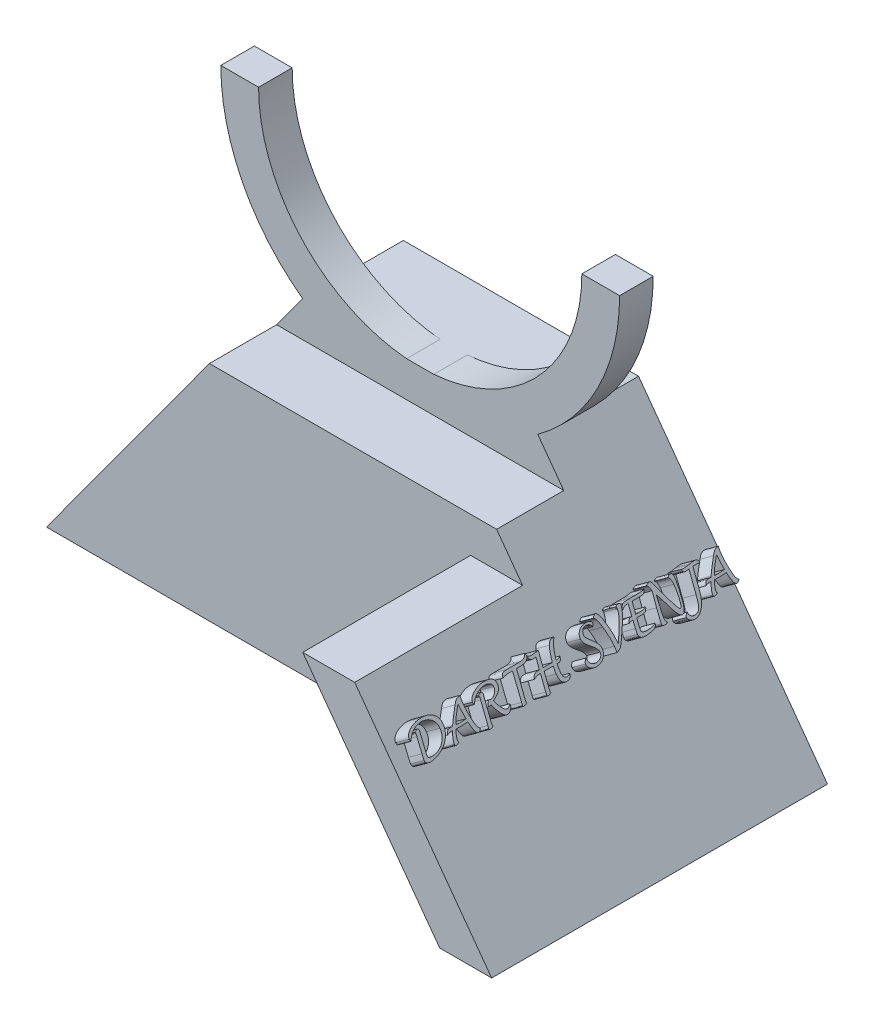
from build123d import *

# Parameters (mm, degrees)
BOSS_EXTRU_1_DEPTH      = 2
BOSS_EXTRU_1_DEPTH_BACK = 2
BOSS_EXTRU_2_DEPTH      = 10
BOSS_EXTRU_2_DEPTH_BACK = 10
BOSS_EXTRU_3_DEPTH      = 20
BOSS_EXTRU_5_DEPTH      = 2
ENL_V_MAT_EXTRU_1_DEPTH = 8


with BuildPart() as part:
    # Esquisse1 → Boss.-Extru.1 (new, two sides: drawn at the far end of the back side and taken through both)
    with BuildSketch(Plane.XY.offset(-BOSS_EXTRU_1_DEPTH_BACK)):
        with BuildLine():
            Line((-23.75, 0), (-19.25, 0))
            ThreePointArc((-19.25, 0), (0, -19.25), (19.25, 0))
            Line((19.25, 0), (23.75, 0))
            ThreePointArc((23.75, 0), (0, -23.75), (-23.75, 0))
        make_face()
    extrude(amount=BOSS_EXTRU_1_DEPTH + BOSS_EXTRU_1_DEPTH_BACK)

    # Esquisse3 → Boss.-Extru.2 (add, two sides: drawn at the far end of the back side and taken through both)
    with BuildSketch(Plane.XY.offset(-BOSS_EXTRU_2_DEPTH_BACK)):
        Polygon((-14.004118262, -19.181949111), (14.004118262, -19.181949111), (36.51, -50), (-36.51, -50), align=None)
    extrude(amount=BOSS_EXTRU_2_DEPTH + BOSS_EXTRU_2_DEPTH_BACK)

    # Esquisse5 → Boss.-Extru.3 (add)
    with BuildSketch(Plane.XY.offset(10)):
        Polygon((36.51, -50), (30.32, -50), (14.004118262, -27.661556125), (20.196626456, -27.661556125), align=None)
    extrude(amount=BOSS_EXTRU_3_DEPTH)

    # Esquisse6 → Boss.-Extru.5 (add)
    # profile 1 of 12: a face of its own
    with BuildSketch(Plane(origin=(-0.002688656, -0.001963478, 0), x_dir=(0, 0, -1), z_dir=(0.807578350374151, 0.5897602970758248, 0))):
        with BuildLine():
            add(Edge.make_bspline(
                [(-28.719086275, -40.691728385), (-28.727919899, -40.671935415), (-28.745427384, -40.632707454), (-28.762216884, -40.571154707), (-28.773990943, -40.509174628), (-28.775110142, -40.467462691), (-28.775671968, -40.446523713)],
                knots=[0, 0, 0, 0, 1.023853834, 2.029190196, 3.010673112, 4, 4, 4, 4], degree=3))
            add(Edge.make_bspline(
                [(-28.775671968, -40.446523713), (-28.773609162, -40.412422102), (-28.769464291, -40.343900467), (-28.738999657, -40.242904429), (-28.688502208, -40.145799743), (-28.619279834, -40.051075207), (-28.529682845, -39.96018546), (-28.421011412, -39.872199614), (-28.29339669, -39.786390229), (-28.148242483, -39.705589178), (-27.991596601, -39.629328985), (-27.826495805, -39.563692608), (-27.656699161, -39.506574096), (-27.481233546, -39.461135886), (-27.30085547, -39.425319352), (-27.115312039, -39.399678513), (-26.924528959, -39.384895228), (-26.795646837, -39.382640022), (-26.730503337, -39.381500128)],
                knots=[0, 0, 0, 0, 0.657509075, 1.321157385, 2.016849548, 2.761350726, 3.576445743, 4.472463111, 5.455528128, 6.540112737, 7.675765552, 8.815115637, 9.966106266, 11.13058958, 12.310083603, 13.512991465, 14.742940932, 16, 16, 16, 16], degree=3))
            add(Edge.make_bspline(
                [(-26.730503337, -39.381500128), (-26.662882992, -39.382737013), (-26.531019593, -39.385149009), (-26.338738331, -39.401754458), (-26.157533127, -39.430704439), (-25.987348189, -39.470749738), (-25.828236429, -39.522766392), (-25.679867598, -39.585715156), (-25.543304301, -39.661823299), (-25.417698498, -39.747714189), (-25.304967993, -39.843916662), (-25.206619135, -39.949300649), (-25.123553782, -40.063531678), (-25.055699347, -40.186404152), (-25.002922554, -40.318116663), (-24.965266138, -40.458268027), (-24.942640173, -40.607011136), (-24.939983147, -40.708938031), (-24.938623047, -40.761113223)],
                knots=[0, 0, 0, 0, 1.273096027, 2.48260741, 3.630112962, 4.725266026, 5.770739582, 6.778281948, 7.754753711, 8.709307781, 9.638798283, 10.539211639, 11.416979257, 12.29120692, 13.175183369, 14.081768753, 15.01807975, 16, 16, 16, 16], degree=3))
            add(Edge.make_bspline(
                [(-24.938623047, -40.761113223), (-24.939090047, -40.79638485), (-24.940019567, -40.866589711), (-24.949067512, -40.971192901), (-24.963904632, -41.074160835), (-24.984175, -41.175346591), (-25.009655352, -41.275166619), (-25.042167632, -41.373072024), (-25.080071608, -41.469704184), (-25.122995628, -41.56483767), (-25.1724707, -41.65808375), (-25.227943892, -41.74957852), (-25.288344396, -41.840111405), (-25.355499259, -41.928247421), (-25.427625076, -42.015439931), (-25.505753604, -42.10097162), (-25.590124239, -42.184519444), (-25.649547265, -42.238184996), (-25.679626174, -42.265349571)],
                knots=[0, 0, 0, 0, 0.977452575, 1.945527505, 2.907561629, 3.859618878, 4.804590704, 5.761112965, 6.716926279, 7.680650018, 8.652299514, 9.640687997, 10.645324625, 11.667278248, 12.7103904, 13.780900877, 14.876730375, 16, 16, 16, 16], degree=3))
            add(Edge.make_bspline(
                [(-25.679626174, -42.265349571), (-25.712968643, -42.293841689), (-25.780122544, -42.351226668), (-25.888108713, -42.430343052), (-26.001433919, -42.506787916), (-26.120953017, -42.579320175), (-26.247023476, -42.647512599), (-26.378744578, -42.711944426), (-26.516622974, -42.772872643), (-26.659463523, -42.828695132), (-26.804576351, -42.87958505), (-26.949183062, -42.924313269), (-27.092534914, -42.961059519), (-27.233902817, -42.992711037), (-27.374116841, -43.015725951), (-27.512439757, -43.033826115), (-27.649190718, -43.044038636), (-27.739824004, -43.045415122), (-27.784748695, -43.046097412)],
                knots=[0, 0, 0, 0, 0.91974542, 1.85242708, 2.806139766, 3.786864752, 4.783846422, 5.811891401, 6.862185191, 7.945097826, 9.028143636, 10.087534963, 11.119210281, 12.131859158, 13.125407561, 14.09878602, 15.057614971, 16, 16, 16, 16], degree=3))
            add(Edge.make_bspline(
                [(-27.784748695, -43.046097412), (-27.805643577, -43.045926478), (-27.846143919, -43.045595158), (-27.904808176, -43.040557173), (-27.959575153, -43.033565017), (-28.009960553, -43.02270891), (-28.056493366, -43.009338946), (-28.098795195, -42.992438172), (-28.137679941, -42.973091283), (-28.172069489, -42.949967054), (-28.202929252, -42.92431767), (-28.229176124, -42.895104891), (-28.251839456, -42.863128889), (-28.269901024, -42.827891642), (-28.284261162, -42.789717718), (-28.294138184, -42.748533198), (-28.300387163, -42.704304273), (-28.301074857, -42.673821714), (-28.301429967, -42.658081229)],
                knots=[0, 0, 0, 0, 1.360560118, 2.637160203, 3.832764921, 4.954421671, 5.991136236, 6.982492785, 7.917889927, 8.814399605, 9.675862417, 10.524943832, 11.36490597, 12.221887154, 13.096657102, 14.015440047, 14.975219387, 16, 16, 16, 16], degree=3))
            add(Edge.make_bspline(
                [(-28.301429967, -42.658081229), (-28.301121004, -42.644825211), (-28.300428698, -42.615121819), (-28.29577222, -42.565973068), (-28.289951986, -42.507312344), (-28.280967482, -42.43928078), (-28.26946033, -42.361813638), (-28.255354495, -42.2751218), (-28.238163515, -42.179113617), (-28.226201732, -42.111985203), (-28.219919623, -42.076730594)],
                knots=[0, 0, 0, 0, 0.54147946, 1.213318843, 2.015571776, 2.949621452, 4.015904618, 5.214713507, 6.537218728, 8, 8, 8, 8], degree=3))
            Line((-28.219919623, -42.076730594), (-27.949116661, -40.594724339))
            add(Edge.make_bspline(
                [(-27.949116661, -40.594724339), (-27.943837639, -40.565102352), (-27.934134337, -40.510654568), (-27.92238097, -40.435494878), (-27.914913632, -40.37369727), (-27.913870471, -40.336734978), (-27.913413783, -40.320553182)],
                knots=[0, 0, 0, 0, 1.304384607, 2.397572197, 3.298469898, 4, 4, 4, 4], degree=3))
            add(Edge.make_bspline(
                [(-27.913413783, -40.320553182), (-27.914166312, -40.307489669), (-27.915649397, -40.281744044), (-27.924385765, -40.24364192), (-27.940916103, -40.207931229), (-27.955764298, -40.186081756), (-27.963263085, -40.175047113)],
                knots=[0, 0, 0, 0, 1.00252214, 1.9757749, 2.977705232, 4, 4, 4, 4], degree=3))
            add(Edge.make_bspline(
                [(-27.963263085, -40.175047113), (-27.940640426, -40.165918016), (-27.897396848, -40.1484676), (-27.834762332, -40.125853987), (-27.777831298, -40.105982875), (-27.726263012, -40.08964613), (-27.679662451, -40.07752353), (-27.638555943, -40.068661637), (-27.60280348, -40.062794774), (-27.580652877, -40.0617016), (-27.570531427, -40.061202087)],
                knots=[0, 0, 0, 0, 1.425737763, 2.725320837, 3.891623633, 4.950155405, 5.886047386, 6.704615923, 7.408089939, 8, 8, 8, 8], degree=3))
            add(Edge.make_bspline(
                [(-27.570531427, -40.061202087), (-27.5601454, -40.061687878), (-27.54064467, -40.062599996), (-27.513255071, -40.070242856), (-27.489656627, -40.082912553), (-27.471237566, -40.102223764), (-27.455794654, -40.125456608), (-27.446255888, -40.154481377), (-27.440078263, -40.188027076), (-27.439487319, -40.212062571), (-27.439171782, -40.224896414)],
                knots=[0, 0, 0, 0, 1.038129704, 1.9491847, 2.824875543, 3.683368585, 4.593868567, 5.596578712, 6.716684152, 8, 8, 8, 8], degree=3))
            add(Edge.make_bspline(
                [(-27.439171782, -40.224896414), (-27.439614322, -40.229836758), (-27.440802395, -40.243099951), (-27.443289669, -40.267895157), (-27.449287325, -40.302592001), (-27.456446569, -40.347312182), (-27.465835914, -40.402156127), (-27.478438662, -40.466655376), (-27.491391732, -40.541608434), (-27.501715836, -40.594743668), (-27.507209342, -40.623017186)],
                knots=[0, 0, 0, 0, 0.294663976, 0.791075689, 1.479673662, 2.385338686, 3.481801968, 4.784642679, 6.289092682, 8, 8, 8, 8], degree=3))
            Line((-27.507209342, -40.623017186), (-27.739614868, -41.867902439))
            add(Edge.make_bspline(
                [(-27.739614868, -41.867902439), (-27.746318296, -41.905856602), (-27.759050962, -41.977947738), (-27.777632044, -42.080194962), (-27.792549248, -42.171619748), (-27.80427259, -42.252100287), (-27.814976685, -42.321350816), (-27.821564054, -42.379570182), (-27.826105623, -42.426728699), (-27.826859998, -42.454635247), (-27.827187965, -42.466767694)],
                knots=[0, 0, 0, 0, 1.527226957, 2.900855148, 4.117895917, 5.197570166, 6.123705076, 6.894066678, 7.519192465, 8, 8, 8, 8], degree=3))
            add(Edge.make_bspline(
                [(-27.827187965, -42.466767694), (-27.82616729, -42.487787015), (-27.824269155, -42.52687636), (-27.806892237, -42.580203514), (-27.776380024, -42.622088156), (-27.740507135, -42.646023866), (-27.706161546, -42.659583682), (-27.67484177, -42.669087166), (-27.638474401, -42.67671199), (-27.597206384, -42.6843599), (-27.550647688, -42.690266135), (-27.49893677, -42.694660822), (-27.442143974, -42.698990397), (-27.402578569, -42.70043801), (-27.381912449, -42.701194138)],
                knots=[0, 0, 0, 0, 1.317892604, 2.450866955, 3.469263134, 4.513890057, 5.108478704, 5.786692803, 6.566942506, 7.44122459, 8.422713262, 9.513276501, 10.701114631, 12, 12, 12, 12], degree=3))
            add(Edge.make_bspline(
                [(-27.381912449, -42.701194138), (-27.313348661, -42.698936383), (-27.178921218, -42.694509785), (-26.981731824, -42.669063653), (-26.793200648, -42.628993648), (-26.613335278, -42.572812692), (-26.441845047, -42.501835249), (-26.278952372, -42.415589462), (-26.12522137, -42.312881303), (-25.981413382, -42.196688564), (-25.850716314, -42.068671426), (-25.735307074, -41.932356186), (-25.637549857, -41.787797413), (-25.556734478, -41.635514606), (-25.49394393, -41.475185365), (-25.448873178, -41.307321684), (-25.419607606, -41.131942973), (-25.415137932, -41.012047695), (-25.412865048, -40.951079479)],
                knots=[0, 0, 0, 0, 1.122741769, 2.201268458, 3.2505137, 4.275014275, 5.282141901, 6.28544362, 7.287835468, 8.304760682, 9.308338569, 10.279036961, 11.224343396, 12.160171412, 13.096230519, 14.037186872, 15.001885502, 16, 16, 16, 16], degree=3))
            add(Edge.make_bspline(
                [(-25.412865048, -40.951079479), (-25.414593636, -40.904292436), (-25.417984987, -40.812499997), (-25.439375455, -40.678895619), (-25.472378212, -40.552464491), (-25.517551051, -40.433311191), (-25.575166495, -40.321451576), (-25.644969822, -40.216821268), (-25.727835206, -40.120183912), (-25.822215404, -40.031483377), (-25.926677157, -39.951346037), (-26.040276008, -39.880861988), (-26.162907515, -39.821840617), (-26.293695433, -39.772074095), (-26.433292117, -39.734401434), (-26.581152678, -39.705798089), (-26.737514005, -39.688404172), (-26.844754681, -39.685020541), (-26.899586777, -39.683290492)],
                knots=[0, 0, 0, 0, 1.023905688, 2.008821146, 2.954096473, 3.879593546, 4.791750725, 5.702251544, 6.626024671, 7.571644861, 8.531989578, 9.503013596, 10.492088963, 11.506158406, 12.561313037, 13.652365579, 14.799655871, 16, 16, 16, 16], degree=3))
            add(Edge.make_bspline(
                [(-26.899586777, -39.683290492), (-26.944983953, -39.684712365), (-27.035307848, -39.687541376), (-27.169531175, -39.70239303), (-27.301467984, -39.723423459), (-27.431003866, -39.753471271), (-27.558058983, -39.791163267), (-27.683200875, -39.836415024), (-27.805911957, -39.889562015), (-27.925460643, -39.951167982), (-28.042133365, -40.018565439), (-28.15335278, -40.094546292), (-28.260041645, -40.176793138), (-28.36188751, -40.265946547), (-28.459261631, -40.361819122), (-28.551393717, -40.464940578), (-28.638713603, -40.574932676), (-28.692133232, -40.652560846), (-28.719086275, -40.691728385)],
                knots=[0, 0, 0, 0, 1.005909195, 2.001394052, 2.989367403, 3.964443479, 4.945087559, 5.923925511, 6.910959039, 7.905486286, 8.902064426, 9.89414995, 10.88722036, 11.884977406, 12.89107111, 13.912762582, 14.946877755, 16, 16, 16, 16], degree=3))
        make_face()
    # profile 2 of 12: a face of its own
    with BuildSketch(Plane(origin=(-0.002688656, -0.001963478, 0), x_dir=(0, 0, -1), z_dir=(0.807578350374151, 0.5897602970758248, 0))):
        with BuildLine():
            Line((-23.945678856, -41.69747172), (-23.992833601, -41.785044817))
            add(Edge.make_bspline(
                [(-23.992833601, -41.785044817), (-24.016531519, -41.828652996), (-24.062193616, -41.912678979), (-24.122608155, -42.036940449), (-24.175026438, -42.152949287), (-24.216909246, -42.262141293), (-24.250451298, -42.363110179), (-24.273426571, -42.457071418), (-24.288797493, -42.543058525), (-24.290924355, -42.598296472), (-24.291929408, -42.624399269)],
                knots=[0, 0, 0, 0, 1.324821505, 2.552719057, 3.687881795, 4.722113956, 5.673775673, 6.525777998, 7.303353612, 8, 8, 8, 8], degree=3))
            add(Edge.make_bspline(
                [(-24.291929408, -42.624399269), (-24.291297881, -42.639125808), (-24.290026872, -42.668764348), (-24.274730611, -42.711800306), (-24.254401834, -42.75528523), (-24.23391028, -42.781271098), (-24.223218209, -42.794829988)],
                knots=[0, 0, 0, 0, 0.938559028, 1.888938061, 2.898491434, 4, 4, 4, 4], degree=3))
            add(Edge.make_bspline(
                [(-24.223218209, -42.794829988), (-24.234466448, -42.798815792), (-24.262735096, -42.808832765), (-24.3125436, -42.828630588), (-24.378931089, -42.854070953), (-24.428250436, -42.873590329), (-24.455623736, -42.884424002)],
                knots=[0, 0, 0, 0, 0.574865508, 1.444730305, 2.581770293, 4, 4, 4, 4], degree=3))
            add(Edge.make_bspline(
                [(-24.455623736, -42.884424002), (-24.482752932, -42.893848521), (-24.534542359, -42.911839854), (-24.589234047, -42.915172026), (-24.615276228, -42.916758684)],
                knots=[0, 0, 0, 0, 1.047673164, 2, 2, 2, 2], degree=3))
            add(Edge.make_bspline(
                [(-24.615276228, -42.916758684), (-24.626968922, -42.916144104), (-24.649215566, -42.914974797), (-24.680637424, -42.908925012), (-24.707077783, -42.8961591), (-24.729323564, -42.879414796), (-24.745898129, -42.856517206), (-24.758057995, -42.829526131), (-24.764541656, -42.797363867), (-24.765603426, -42.774647313), (-24.76617141, -42.762495306)],
                knots=[0, 0, 0, 0, 1.136958803, 2.163189862, 3.079835354, 3.965094871, 4.837102466, 5.793333447, 6.819564506, 8, 8, 8, 8], degree=3))
            add(Edge.make_bspline(
                [(-24.76617141, -42.762495306), (-24.764751767, -42.733915736), (-24.761724427, -42.672970767), (-24.743721341, -42.576628869), (-24.714168744, -42.47011355), (-24.67326164, -42.353152052), (-24.621899543, -42.225321572), (-24.55795975, -42.087466731), (-24.483387803, -41.93860875), (-24.427470477, -41.837171351), (-24.398364403, -41.784371178)],
                knots=[0, 0, 0, 0, 0.651111391, 1.388473108, 2.225879921, 3.167140451, 4.208911145, 5.362248168, 6.626997984, 8, 8, 8, 8], degree=3))
            Line((-24.398364403, -41.784371178), (-24.332347761, -41.666484317))
            Line((-24.332347761, -41.666484317), (-24.440803673, -41.666484317))
            add(Edge.make_bspline(
                [(-24.440803673, -41.666484317), (-24.469103119, -41.666921862), (-24.524182559, -41.667773459), (-24.604273649, -41.672920213), (-24.679343021, -41.682523773), (-24.749625578, -41.69504087), (-24.815036254, -41.711645151), (-24.875234836, -41.732815586), (-24.930900435, -41.756696359), (-24.965056131, -41.776195912), (-24.981735956, -41.785718456)],
                knots=[0, 0, 0, 0, 1.211373888, 2.357706733, 3.433019308, 4.449144512, 5.411912512, 6.317728502, 7.178468099, 8, 8, 8, 8], degree=3))
            add(Edge.make_bspline(
                [(-24.981735956, -41.785718456), (-24.972358329, -41.752603758), (-24.954349555, -41.689010365), (-24.912881301, -41.601917686), (-24.859974003, -41.52790777), (-24.79558042, -41.46755176), (-24.720257477, -41.42074214), (-24.634312836, -41.387946646), (-24.537570872, -41.368213981), (-24.469644507, -41.365903889), (-24.434067281, -41.364693952)],
                knots=[0, 0, 0, 0, 1.091559776, 2.096229002, 3.046215765, 3.964411154, 4.88052745, 5.844567996, 6.871067346, 8, 8, 8, 8], degree=3))
            Line((-24.434067281, -41.364693952), (-24.165958877, -41.372103983))
            Line((-24.165958877, -41.372103983), (-24.102636791, -41.283857247))
            add(Edge.make_bspline(
                [(-24.102636791, -41.283857247), (-24.070248762, -41.238598069), (-24.002289658, -41.143631709), (-23.892098962, -40.997207386), (-23.770933999, -40.838470393), (-23.63681863, -40.669135178), (-23.490699522, -40.488531116), (-23.331778327, -40.297455521), (-23.162614071, -40.09358363), (-23.044095946, -39.955275915), (-22.98304843, -39.884034976)],
                knots=[0, 0, 0, 0, 0.744900075, 1.563007794, 2.452692072, 3.417768624, 4.454190493, 5.562092292, 6.744257807, 8, 8, 8, 8], degree=3))
            add(Edge.make_bspline(
                [(-22.98304843, -39.884034976), (-22.962747405, -39.860339645), (-22.923723545, -39.814791046), (-22.865634854, -39.751328606), (-22.812819229, -39.69345851), (-22.762930361, -39.644044612), (-22.717749022, -39.600871474), (-22.675999033, -39.565611476), (-22.639196477, -39.535783803), (-22.603551604, -39.513115428), (-22.566420052, -39.493831431), (-22.523724082, -39.476559871), (-22.473449238, -39.459880587), (-22.416140405, -39.44327476), (-22.351381246, -39.427109479), (-22.279547648, -39.410955603), (-22.200015939, -39.395512033), (-22.144391922, -39.386300898), (-22.115401132, -39.381500128)],
                knots=[0, 0, 0, 0, 1.440193478, 2.768427161, 3.971228752, 5.055958141, 6.009211906, 6.854653189, 7.578284668, 8.193592778, 8.800904397, 9.507331817, 10.316940583, 11.245241858, 12.260865785, 13.397490857, 14.643593135, 16, 16, 16, 16], degree=3))
            add(Edge.make_bspline(
                [(-22.115401132, -39.381500128), (-22.125435179, -39.448114761), (-22.145118794, -39.578791514), (-22.16381945, -39.772176975), (-22.177009091, -39.958401624), (-22.178611287, -40.080266524), (-22.179396856, -40.140017874)],
                knots=[0, 0, 0, 0, 1.06078274, 2.080918813, 3.059058908, 4, 4, 4, 4], degree=3))
            add(Edge.make_bspline(
                [(-22.179396856, -40.140017874), (-22.178668059, -40.217718366), (-22.177207841, -40.373399172), (-22.167881099, -40.607288197), (-22.150670589, -40.841753734), (-22.127650161, -41.077129627), (-22.099262062, -41.313357988), (-22.062096331, -41.550152399), (-22.020360088, -41.787975081), (-21.986761391, -41.946137506), (-21.969895063, -42.025534014)],
                knots=[0, 0, 0, 0, 0.981089636, 1.965712471, 2.954912851, 3.949090229, 4.95169345, 5.958564985, 6.975212914, 8, 8, 8, 8], degree=3))
            add(Edge.make_bspline(
                [(-21.969895063, -42.025534014), (-21.960020856, -42.067420342), (-21.941049385, -42.147897216), (-21.906475049, -42.261861264), (-21.869587866, -42.364822241), (-21.826853208, -42.455391975), (-21.781248203, -42.534792666), (-21.732206092, -42.60284982), (-21.678911535, -42.659603504), (-21.638504914, -42.688528207), (-21.618929036, -42.702541417)],
                knots=[0, 0, 0, 0, 1.323465202, 2.542794941, 3.661692741, 4.684463506, 5.619197963, 6.474393482, 7.260886307, 8, 8, 8, 8], degree=3))
            add(Edge.make_bspline(
                [(-21.618929036, -42.702541417), (-21.635775428, -42.719614421), (-21.667938904, -42.75221055), (-21.717724242, -42.795512036), (-21.764967811, -42.832850231), (-21.811253531, -42.862534481), (-21.854905817, -42.886623688), (-21.896909506, -42.903654168), (-21.937222792, -42.914666833), (-21.963769329, -42.91607595), (-21.976631455, -42.916758684)],
                knots=[0, 0, 0, 0, 1.348530202, 2.574641471, 3.708916349, 4.731835064, 5.66420327, 6.50849859, 7.27734911, 8, 8, 8, 8], degree=3))
            add(Edge.make_bspline(
                [(-21.976631455, -42.916758684), (-21.991126425, -42.915872891), (-22.02064525, -42.914068983), (-22.06355139, -42.898211706), (-22.104903348, -42.873081916), (-22.14457702, -42.838316979), (-22.182494983, -42.793465626), (-22.219160951, -42.739215081), (-22.255807467, -42.675793493), (-22.289621587, -42.601984337), (-22.322513149, -42.518667349), (-22.354931805, -42.425996521), (-22.384786154, -42.323022441), (-22.41446657, -42.210775796), (-22.442741516, -42.088558154), (-22.469210232, -41.956579497), (-22.496051745, -41.815039777), (-22.511128791, -41.717058633), (-22.518911017, -41.666484317)],
                knots=[0, 0, 0, 0, 0.484134147, 0.985933152, 1.512100814, 2.098544961, 2.743711532, 3.473747281, 4.288938213, 5.193873909, 6.189495729, 7.288203118, 8.480243729, 9.778898377, 11.176136066, 12.680386985, 14.286536047, 16, 16, 16, 16], degree=3))
            add(Edge.make_bspline(
                [(-22.518911017, -41.666484317), (-22.583771162, -41.673156831), (-22.713566421, -41.686509571), (-22.909254419, -41.69962271), (-23.105799877, -41.70806055), (-23.237226214, -41.709084545), (-23.303027053, -41.709597226)],
                knots=[0, 0, 0, 0, 0.99579624, 1.992743469, 2.995032764, 4, 4, 4, 4], degree=3))
            Line((-23.303027053, -41.709597226), (-23.945678856, -41.69747172))
        make_face()
        with BuildLine():
            Line((-23.775248137, -41.395681356), (-23.299658857, -41.407806861))
            add(Edge.make_bspline(
                [(-23.299658857, -41.407806861), (-23.260138502, -41.407622017), (-23.18356569, -41.40726387), (-23.072404545, -41.406094808), (-22.968424612, -41.403465118), (-22.871426974, -41.399286395), (-22.781598376, -41.394659513), (-22.69892973, -41.389412134), (-22.62343173, -41.382877302), (-22.575482165, -41.376952948), (-22.552592977, -41.374124901)],
                knots=[0, 0, 0, 0, 1.267591842, 2.456027306, 3.565526337, 4.603530068, 5.569928731, 6.450473217, 7.260318396, 8, 8, 8, 8], degree=3))
            add(Edge.make_bspline(
                [(-22.552592977, -41.374124901), (-22.560540594, -41.311038754), (-22.576088058, -41.187626975), (-22.597367012, -41.00671957), (-22.613936447, -40.833726301), (-22.628096284, -40.669126807), (-22.639808091, -40.512857416), (-22.647915735, -40.36485637), (-22.652921287, -40.225156637), (-22.653404909, -40.134632573), (-22.653638858, -40.090842212)],
                knots=[0, 0, 0, 0, 1.184726562, 2.31761202, 3.393754763, 4.422539401, 5.395778743, 6.313401045, 7.184119969, 8, 8, 8, 8], degree=3))
            Line((-22.653638858, -40.090842212), (-22.653638858, -39.925800607))
            add(Edge.make_bspline(
                [(-22.653638858, -39.925800607), (-22.66103328, -39.934571227), (-22.677972763, -39.954663368), (-22.706609495, -39.987794842), (-22.741330635, -40.028061024), (-22.7820701, -40.074683064), (-22.828922708, -40.128417508), (-22.881776105, -40.188521597), (-22.940760495, -40.255723704), (-22.982138071, -40.302600181), (-23.003931245, -40.327289574)],
                knots=[0, 0, 0, 0, 0.516713527, 1.183711142, 1.972485502, 2.911578061, 3.972455949, 5.183665523, 6.516663488, 8, 8, 8, 8], degree=3))
            add(Edge.make_bspline(
                [(-23.003931245, -40.327289574), (-23.043885287, -40.373368543), (-23.121774022, -40.463197566), (-23.232196626, -40.597534561), (-23.334715997, -40.726813211), (-23.42931034, -40.851503209), (-23.51568363, -40.972059354), (-23.593560965, -41.088246813), (-23.66372219, -41.199620434), (-23.705254508, -41.273582084), (-23.725398836, -41.309455537)],
                knots=[0, 0, 0, 0, 1.198833384, 2.337075579, 3.417995292, 4.442055931, 5.41338966, 6.332787451, 7.191355622, 8, 8, 8, 8], degree=3))
            Line((-23.725398836, -41.309455537), (-23.775248137, -41.395681356))
        make_face(mode=Mode.SUBTRACT)
    # profile 3 of 12: a face of its own
    with BuildSketch(Plane(origin=(-0.002688656, -0.001963478, 0), x_dir=(0, 0, -1), z_dir=(0.807578350374151, 0.5897602970758248, 0))):
        with BuildLine():
            add(Edge.make_bspline(
                [(-21.133908808, -40.680276518), (-21.148856054, -40.661942715), (-21.178382676, -40.625726326), (-21.208504276, -40.562351794), (-21.22772424, -40.494359046), (-21.229834034, -40.44710775), (-21.230912853, -40.422946341)],
                knots=[0, 0, 0, 0, 1.006206268, 1.987648546, 2.971007112, 4, 4, 4, 4], degree=3))
            add(Edge.make_bspline(
                [(-21.230912853, -40.422946341), (-21.228934152, -40.391267168), (-21.224915612, -40.326930022), (-21.192284067, -40.232574501), (-21.141348785, -40.140262094), (-21.069670414, -40.050283042), (-20.978465421, -39.961925773), (-20.866842587, -39.876138331), (-20.736079156, -39.791265599), (-20.588184275, -39.709624669), (-20.428951697, -39.633342633), (-20.263942802, -39.565787903), (-20.09577074, -39.509227384), (-19.925049657, -39.462695269), (-19.751471858, -39.425933823), (-19.574791262, -39.400785104), (-19.395319976, -39.384685433), (-19.274698709, -39.382566008), (-19.214037069, -39.381500128)],
                knots=[0, 0, 0, 0, 0.624039394, 1.267359864, 1.949680873, 2.697963963, 3.528510769, 4.450549225, 5.472088057, 6.602957789, 7.782459839, 8.95528147, 10.119968563, 11.282232923, 12.446143939, 13.619493033, 14.802819247, 16, 16, 16, 16], degree=3))
            add(Edge.make_bspline(
                [(-19.214037069, -39.381500128), (-19.168437021, -39.381912293), (-19.080065645, -39.382711057), (-18.951943928, -39.391828265), (-18.832437431, -39.405423194), (-18.721753351, -39.425652992), (-18.619765806, -39.451123578), (-18.526359474, -39.481548256), (-18.442271349, -39.519119498), (-18.36623088, -39.560972444), (-18.299776657, -39.610006423), (-18.24164036, -39.664137012), (-18.19290451, -39.724597646), (-18.152560564, -39.790630916), (-18.121644205, -39.862598633), (-18.099211838, -39.939932713), (-18.086535983, -40.023062839), (-18.084644749, -40.080246126), (-18.08367048, -40.10970411)],
                knots=[0, 0, 0, 0, 1.43808068, 2.78695259, 4.049394859, 5.230243057, 6.333086877, 7.363379882, 8.32415917, 9.234315325, 10.095621658, 10.922365893, 11.733180254, 12.537316019, 13.355735732, 14.19632017, 15.070833903, 16, 16, 16, 16], degree=3))
            add(Edge.make_bspline(
                [(-18.08367048, -40.10970411), (-18.084500738, -40.138479237), (-18.086141943, -40.195360159), (-18.097538638, -40.278951887), (-18.117477049, -40.359148056), (-18.144237769, -40.436302339), (-18.179495518, -40.510174538), (-18.223181659, -40.580431391), (-18.273542033, -40.647923192), (-18.332713518, -40.712402935), (-18.401869879, -40.774487349), (-18.481087286, -40.837527901), (-18.572333643, -40.900409046), (-18.675005916, -40.964557003), (-18.789507784, -41.02866904), (-18.915191595, -41.094281207), (-19.052562332, -41.16012131), (-19.148798207, -41.202612785), (-19.198543367, -41.224576997)],
                knots=[0, 0, 0, 0, 0.821997726, 1.624875137, 2.404347579, 3.179346267, 3.954052867, 4.737395904, 5.539247601, 6.356526068, 7.232917326, 8.191669106, 9.246920562, 10.396747937, 11.64913248, 12.994791579, 14.446581666, 16, 16, 16, 16], degree=3))
            add(Edge.make_bspline(
                [(-19.198543367, -41.224576997), (-19.17580619, -41.272037506), (-19.131548546, -41.364418822), (-19.064307225, -41.497672579), (-18.998352293, -41.621695231), (-18.933683015, -41.73662239), (-18.869861715, -41.84220095), (-18.80729321, -41.938661164), (-18.745982663, -42.026056604), (-18.685517603, -42.103877099), (-18.626851246, -42.173314882), (-18.569132971, -42.23329867), (-18.512588251, -42.284244556), (-18.456980679, -42.32589021), (-18.402515961, -42.358653861), (-18.348918333, -42.38199393), (-18.296382918, -42.396319468), (-18.261591141, -42.398394559), (-18.24467025, -42.399403774)],
                knots=[0, 0, 0, 0, 1.611880824, 3.137506892, 4.571320694, 5.914090463, 7.176194773, 8.349414794, 9.435188553, 10.444980687, 11.367038566, 12.218244714, 12.992750466, 13.695664344, 14.343235156, 14.934763699, 15.481925088, 16, 16, 16, 16], degree=3))
            add(Edge.make_bspline(
                [(-18.24467025, -42.399403774), (-18.226850557, -42.398664198), (-18.190536916, -42.397157062), (-18.136054004, -42.383149815), (-18.080462052, -42.362396191), (-18.024518814, -42.332089702), (-17.967496459, -42.293953953), (-17.909855544, -42.247226731), (-17.850842892, -42.192338318), (-17.813039138, -42.151327234), (-17.793331982, -42.129948091)],
                knots=[0, 0, 0, 0, 0.789717356, 1.609315726, 2.48312682, 3.419508645, 4.42580367, 5.524831846, 6.709690921, 8, 8, 8, 8], degree=3))
            add(Edge.make_bspline(
                [(-17.793331982, -42.129948091), (-17.789955685, -42.146505031), (-17.784459692, -42.173456698), (-17.782598096, -42.200881304), (-17.781880115, -42.211458435)],
                knots=[0, 0, 0, 0, 1.228639377, 2, 2, 2, 2], degree=3))
            add(Edge.make_bspline(
                [(-17.781880115, -42.211458435), (-17.782502923, -42.227906876), (-17.78377015, -42.261374498), (-17.795249287, -42.311682464), (-17.813594305, -42.362228951), (-17.839109143, -42.413378272), (-17.871226487, -42.464909926), (-17.911218908, -42.516534448), (-17.957515714, -42.569022441), (-18.010428008, -42.620344738), (-18.06662846, -42.668167355), (-18.12249878, -42.712287558), (-18.178996928, -42.748189806), (-18.234560539, -42.778555616), (-18.289722013, -42.801427059), (-18.344548348, -42.817884399), (-18.398748401, -42.828485329), (-18.435040389, -42.829859482), (-18.452824765, -42.830532866)],
                knots=[0, 0, 0, 0, 0.802955801, 1.633773132, 2.508507242, 3.426237964, 4.421944859, 5.471065796, 6.61385791, 7.839967634, 9.06951006, 10.219654772, 11.315485796, 12.336687199, 13.310814164, 14.227363174, 15.131344344, 16, 16, 16, 16], degree=3))
            add(Edge.make_bspline(
                [(-18.452824765, -42.830532866), (-18.475613292, -42.829541603), (-18.521804779, -42.827532351), (-18.590856239, -42.809157956), (-18.660393949, -42.781569931), (-18.730390547, -42.742383328), (-18.800655073, -42.692020404), (-18.870944016, -42.63018001), (-18.94303831, -42.558423718), (-19.014371958, -42.47478454), (-19.086707477, -42.380388333), (-19.16020938, -42.275480128), (-19.232955367, -42.158686158), (-19.307621982, -42.031611103), (-19.381821094, -41.893221209), (-19.456567255, -41.743610996), (-19.53305269, -41.58360278), (-19.581734403, -41.471956688), (-19.606768726, -41.414543253)],
                knots=[0, 0, 0, 0, 0.573639296, 1.162745273, 1.790421036, 2.456935681, 3.17961665, 3.966310162, 4.815061127, 5.742380393, 6.735549417, 7.813045386, 8.970754631, 10.204001627, 11.528889853, 12.929122686, 14.420816968, 16, 16, 16, 16], degree=3))
            add(Edge.make_bspline(
                [(-19.606768726, -41.414543253), (-19.62621299, -41.420324732), (-19.663868812, -41.431521162), (-19.719985777, -41.441359519), (-19.772891256, -41.45009609), (-19.807478063, -41.450649663), (-19.82435419, -41.450919771)],
                knots=[0, 0, 0, 0, 1.098563966, 2.127482338, 3.086332395, 4, 4, 4, 4], degree=3))
            add(Edge.make_bspline(
                [(-19.82435419, -41.450919771), (-19.839820062, -41.450230649), (-19.870383358, -41.448868823), (-19.898641958, -41.437165401), (-19.912600926, -41.431384234)],
                knots=[0, 0, 0, 0, 1.012055225, 2, 2, 2, 2], degree=3))
            add(Edge.make_bspline(
                [(-19.912600926, -41.431384234), (-19.905213742, -41.395654452), (-19.891187563, -41.327813677), (-19.856996585, -41.234992055), (-19.816485464, -41.15511328), (-19.766033556, -41.090132322), (-19.707719869, -41.038450677), (-19.640241945, -41.002113067), (-19.564242804, -40.980862798), (-19.511024538, -40.978104658), (-19.483492751, -40.976677769)],
                knots=[0, 0, 0, 0, 1.272134033, 2.415423591, 3.442863331, 4.38688438, 5.270374423, 6.143790294, 7.03971377, 8, 8, 8, 8], degree=3))
            add(Edge.make_bspline(
                [(-19.483492751, -40.976677769), (-19.471350831, -40.977154937), (-19.445619452, -40.978166159), (-19.405355367, -40.983940297), (-19.360982052, -40.992672639), (-19.330523426, -41.001156091), (-19.31440931, -41.005644255)],
                knots=[0, 0, 0, 0, 0.847148224, 1.795292008, 2.833600715, 4, 4, 4, 4], degree=3))
            add(Edge.make_bspline(
                [(-19.31440931, -41.005644255), (-19.283720083, -40.99526355), (-19.223747466, -40.974977668), (-19.13832474, -40.93854601), (-19.057986533, -40.901611499), (-18.984442445, -40.860524021), (-18.915752968, -40.818669952), (-18.854086736, -40.772266178), (-18.79671052, -40.725055135), (-18.747152362, -40.673174243), (-18.702142968, -40.620091649), (-18.663521035, -40.563909604), (-18.631330013, -40.505014655), (-18.603857781, -40.443968892), (-18.582882077, -40.380087719), (-18.569379007, -40.313322906), (-18.558963133, -40.244530241), (-18.558266165, -40.197543679), (-18.557912481, -40.173699835)],
                knots=[0, 0, 0, 0, 1.283436917, 2.508081078, 3.678464745, 4.785706272, 5.845027767, 6.863102135, 7.841874503, 8.78584348, 9.701925432, 10.597948113, 11.482182558, 12.35863575, 13.247915987, 14.139819409, 15.056031023, 16, 16, 16, 16], degree=3))
            add(Edge.make_bspline(
                [(-18.557912481, -40.173699835), (-18.558512181, -40.156128426), (-18.559691209, -40.121582517), (-18.570468324, -40.071167313), (-18.586404858, -40.022982278), (-18.609533524, -39.977160807), (-18.640533143, -39.934733367), (-18.677171679, -39.894184316), (-18.7198646, -39.855255396), (-18.769597206, -39.820312674), (-18.823911752, -39.788177624), (-18.882059105, -39.759494987), (-18.944286882, -39.736323275), (-19.009877576, -39.716407148), (-19.079375163, -39.701977163), (-19.152470699, -39.691222698), (-19.229170201, -39.684218465), (-19.28161004, -39.683603853), (-19.308346558, -39.683290492)],
                knots=[0, 0, 0, 0, 0.847618176, 1.666442469, 2.479211992, 3.294004772, 4.133606971, 5.009005347, 5.930353219, 6.917453908, 7.938521679, 8.97643942, 10.043906956, 11.141843224, 12.284036778, 13.468041205, 14.709077639, 16, 16, 16, 16], degree=3))
            add(Edge.make_bspline(
                [(-19.308346558, -39.683290492), (-19.354416005, -39.683942179), (-19.44653025, -39.685245203), (-19.583692478, -39.699678375), (-19.719767941, -39.720601748), (-19.854071324, -39.752356958), (-19.987439047, -39.791005096), (-20.119528926, -39.83918985), (-20.249805607, -39.896546798), (-20.37776755, -39.961542863), (-20.501031304, -40.032934724), (-20.61686516, -40.110389663), (-20.724580894, -40.192549128), (-20.823056999, -40.280518868), (-20.913654375, -40.372924604), (-20.996009734, -40.470027432), (-21.070290923, -40.572069185), (-21.112702031, -40.644206021), (-21.133908808, -40.680276518)],
                knots=[0, 0, 0, 0, 1.017105031, 2.033665829, 3.043051799, 4.055989044, 5.079205765, 6.108390352, 7.158804302, 8.221196896, 9.276796145, 10.302905264, 11.296821743, 12.266323543, 13.216724594, 14.152718375, 15.07630593, 16, 16, 16, 16], degree=3))
        make_face()
    # profile 4 of 12: a face of its own
    with BuildSketch(Plane(origin=(-0.002688656, -0.001963478, 0), x_dir=(0, 0, -1), z_dir=(0.807578350374151, 0.5897602970758248, 0))):
        with BuildLine():
            add(Edge.make_bspline(
                [(-20.314763532, -43.056875639), (-20.351479956, -43.074942146), (-20.421551185, -43.109421058), (-20.52785106, -43.14690578), (-20.62897391, -43.17064358), (-20.695255694, -43.173883124), (-20.727030727, -43.17543614)],
                knots=[0, 0, 0, 0, 1.133570083, 2.163354681, 3.119524815, 4, 4, 4, 4], degree=3))
            add(Edge.make_bspline(
                [(-20.727030727, -43.17543614), (-20.744031329, -43.174533572), (-20.774520522, -43.172914891), (-20.815095554, -43.155521406), (-20.839740771, -43.121465228), (-20.841794758, -43.094772815), (-20.84289667, -43.080453011)],
                knots=[0, 0, 0, 0, 1.19500757, 2.143148591, 3.003846263, 4, 4, 4, 4], degree=3))
            add(Edge.make_bspline(
                [(-20.84289667, -43.080453011), (-20.842759355, -43.075281423), (-20.842429689, -43.06286543), (-20.839246555, -43.041573588), (-20.835289444, -43.014625538), (-20.829924641, -42.982009416), (-20.822253783, -42.94370076), (-20.813603747, -42.899444816), (-20.803635338, -42.849516923), (-20.795816575, -42.814574193), (-20.791700091, -42.796177266)],
                knots=[0, 0, 0, 0, 0.429152061, 1.030311869, 1.784300709, 2.691419402, 3.773571282, 5.027528037, 6.435029284, 8, 8, 8, 8], degree=3))
            Line((-20.791700091, -42.796177266), (-20.363265555, -40.599439813))
            add(Edge.make_bspline(
                [(-20.363265555, -40.599439813), (-20.357374766, -40.569845008), (-20.346560131, -40.515513236), (-20.335537505, -40.440140329), (-20.326867898, -40.378458801), (-20.325945361, -40.34145672), (-20.32554176, -40.325268656)],
                knots=[0, 0, 0, 0, 1.306369442, 2.398304938, 3.299273403, 4, 4, 4, 4], degree=3))
            add(Edge.make_bspline(
                [(-20.32554176, -40.325268656), (-20.326613813, -40.312077721), (-20.328777445, -40.285455614), (-20.345870789, -40.247312299), (-20.37186376, -40.210712037), (-20.395740444, -40.190486017), (-20.408399382, -40.179762588)],
                knots=[0, 0, 0, 0, 0.911365936, 1.83932987, 2.854456163, 4, 4, 4, 4], degree=3))
            add(Edge.make_bspline(
                [(-20.408399382, -40.179762588), (-20.384362711, -40.171040038), (-20.338362694, -40.154347318), (-20.272629925, -40.129888501), (-20.211733098, -40.111841014), (-20.157296815, -40.094789011), (-20.107835004, -40.083240295), (-20.064517664, -40.072936496), (-20.026537021, -40.06841482), (-20.003323597, -40.067161381), (-19.992763992, -40.066591201)],
                knots=[0, 0, 0, 0, 1.419376448, 2.716322118, 3.891035406, 4.943931356, 5.880990708, 6.709672629, 7.413040174, 8, 8, 8, 8], degree=3))
            add(Edge.make_bspline(
                [(-19.992763992, -40.066591201), (-19.981729526, -40.067128565), (-19.960733072, -40.068151065), (-19.931094259, -40.075243164), (-19.906277576, -40.088617714), (-19.884789411, -40.106210395), (-19.870713154, -40.131018202), (-19.85857133, -40.159029237), (-19.852152912, -40.192739774), (-19.851596388, -40.216791959), (-19.851299758, -40.229611889)],
                knots=[0, 0, 0, 0, 1.072355364, 2.040485005, 2.928380101, 3.794301576, 4.69602102, 5.66415066, 6.754981102, 8, 8, 8, 8], degree=3))
            add(Edge.make_bspline(
                [(-19.851299758, -40.229611889), (-19.851714448, -40.234555433), (-19.852830018, -40.247854236), (-19.856315575, -40.2725992), (-19.862735043, -40.307083523), (-19.870751005, -40.351555759), (-19.880765451, -40.406181646), (-19.893650313, -40.470838858), (-19.90923412, -40.545323821), (-19.920242544, -40.598315612), (-19.92607371, -40.626385382)],
                knots=[0, 0, 0, 0, 0.294754378, 0.792929161, 1.483931855, 2.37900105, 3.478151852, 4.783917074, 6.296439831, 8, 8, 8, 8], degree=3))
            Line((-19.92607371, -40.626385382), (-20.32554176, -42.641913888))
            add(Edge.make_bspline(
                [(-20.32554176, -42.641913888), (-20.332038803, -42.674436688), (-20.343974814, -42.734185786), (-20.357357908, -42.81618137), (-20.366494158, -42.882653601), (-20.367999434, -42.921903581), (-20.368654669, -42.938988778)],
                knots=[0, 0, 0, 0, 1.324044214, 2.432461082, 3.317663053, 4, 4, 4, 4], degree=3))
            add(Edge.make_bspline(
                [(-20.368654669, -42.938988778), (-20.367931966, -42.947609673), (-20.366386054, -42.966050375), (-20.354855234, -42.994284706), (-20.33805435, -43.025308411), (-20.322913414, -43.045829691), (-20.314763532, -43.056875639)],
                knots=[0, 0, 0, 0, 0.784706332, 1.678542054, 2.750433431, 4, 4, 4, 4], degree=3))
        make_face()
    # profile 5 of 12: a face of its own
    with BuildSketch(Plane(origin=(-0.002688656, -0.001963478, 0), x_dir=(0, 0, -1), z_dir=(0.807578350374151, 0.5897602970758248, 0))):
        with BuildLine():
            Line((-15.626234654, -39.81262922), (-16.142915926, -42.383910072))
            add(Edge.make_bspline(
                [(-16.142915926, -42.383910072), (-16.149276625, -42.416457117), (-16.160799584, -42.475418912), (-16.175265329, -42.554552086), (-16.184253604, -42.615446629), (-16.185990245, -42.649980848), (-16.186702474, -42.664143982)],
                knots=[0, 0, 0, 0, 1.401604579, 2.53912826, 3.400868996, 4, 4, 4, 4], degree=3))
            add(Edge.make_bspline(
                [(-16.186702474, -42.664143982), (-16.185259191, -42.686371017), (-16.182200626, -42.733473917), (-16.165309309, -42.777592791), (-16.15638871, -42.800892741)],
                knots=[0, 0, 0, 0, 0.943765024, 2, 2, 2, 2], degree=3))
            add(Edge.make_bspline(
                [(-16.15638871, -42.800892741), (-16.191777534, -42.818451731), (-16.259258474, -42.851933972), (-16.360954168, -42.888721796), (-16.457366646, -42.911850399), (-16.52026588, -42.915166447), (-16.550467646, -42.916758684)],
                knots=[0, 0, 0, 0, 1.142981375, 2.179486264, 3.125860123, 4, 4, 4, 4], degree=3))
            add(Edge.make_bspline(
                [(-16.550467646, -42.916758684), (-16.56687895, -42.915988056), (-16.596341922, -42.914604558), (-16.634644892, -42.895565139), (-16.658495828, -42.862027614), (-16.660087421, -42.83542638), (-16.660944475, -42.821101917)],
                knots=[0, 0, 0, 0, 1.175582152, 2.1105053, 2.982528509, 4, 4, 4, 4], degree=3))
            add(Edge.make_bspline(
                [(-16.660944475, -42.821101917), (-16.660768855, -42.816158692), (-16.660344871, -42.804224692), (-16.658119178, -42.783562545), (-16.654685926, -42.757072343), (-16.649912707, -42.724741206), (-16.643892753, -42.686559672), (-16.636375986, -42.642564615), (-16.627626599, -42.592713355), (-16.621219925, -42.557480846), (-16.617831566, -42.538847089)],
                knots=[0, 0, 0, 0, 0.415422436, 1.002918479, 1.744610869, 2.659629722, 3.748161709, 4.991713678, 6.408978644, 8, 8, 8, 8], degree=3))
            Line((-16.617831566, -42.538847089), (-16.100476656, -39.81262922))
            Line((-16.100476656, -39.81262922), (-16.406982495, -39.81262922))
            add(Edge.make_bspline(
                [(-16.406982495, -39.81262922), (-16.449653568, -39.813006679), (-16.533692454, -39.813750069), (-16.657495806, -39.819928596), (-16.777037346, -39.8299554), (-16.892107279, -39.844003477), (-17.00270368, -39.862106726), (-17.108569121, -39.884342104), (-17.210048485, -39.910376905), (-17.275401655, -39.931532583), (-17.307638114, -39.941967948)],
                knots=[0, 0, 0, 0, 1.120541811, 2.206860021, 3.254344379, 4.270281703, 5.250384162, 6.196420316, 7.11035651, 8, 8, 8, 8], degree=3))
            add(Edge.make_bspline(
                [(-17.307638114, -39.941967948), (-17.30133964, -39.916763171), (-17.289289454, -39.868541609), (-17.268640182, -39.80023592), (-17.245658772, -39.739592691), (-17.221771808, -39.685894233), (-17.1954256, -39.63998306), (-17.168171058, -39.601116675), (-17.138636784, -39.57006233), (-17.106492254, -39.544983127), (-17.067671916, -39.526615616), (-17.021460709, -39.510376572), (-16.965535604, -39.4977094), (-16.900620422, -39.48608294), (-16.826366152, -39.477673014), (-16.74276573, -39.47172792), (-16.649740566, -39.468603007), (-16.58460068, -39.468027506), (-16.550467646, -39.467725946)],
                knots=[0, 0, 0, 0, 1.223005182, 2.339843019, 3.356866037, 4.274603304, 5.103270321, 5.845507268, 6.503466398, 7.114489102, 7.752705378, 8.514996359, 9.417508566, 10.448120507, 11.619030987, 12.933292266, 14.393057678, 16, 16, 16, 16], degree=3))
            Line((-16.550467646, -39.467725946), (-15.016591172, -39.467725946))
            add(Edge.make_bspline(
                [(-15.016591172, -39.467725946), (-14.967116125, -39.466543012), (-14.871985311, -39.464268461), (-14.735867223, -39.443974141), (-14.612710267, -39.410783239), (-14.502696267, -39.363390314), (-14.405610456, -39.302240711), (-14.32172813, -39.227253527), (-14.250768407, -39.138468888), (-14.215877822, -39.070957947), (-14.198119536, -39.036596854)],
                knots=[0, 0, 0, 0, 1.208628186, 2.323954972, 3.354505194, 4.317990757, 5.240644316, 6.146246987, 7.056493975, 8, 8, 8, 8], degree=3))
            add(Edge.make_bspline(
                [(-14.198119536, -39.036596854), (-14.185693953, -39.056991343), (-14.162633445, -39.09484126), (-14.138142271, -39.151177211), (-14.120367228, -39.200573054), (-14.118250088, -39.232284363), (-14.117282831, -39.246772286)],
                knots=[0, 0, 0, 0, 1.256623651, 2.332154608, 3.238012682, 4, 4, 4, 4], degree=3))
            add(Edge.make_bspline(
                [(-14.117282831, -39.246772286), (-14.118464888, -39.270238797), (-14.120805999, -39.316715144), (-14.139070792, -39.384223584), (-14.168441635, -39.448171413), (-14.21074158, -39.507804992), (-14.263579817, -39.56489661), (-14.329105915, -39.61723248), (-14.405985567, -39.665864645), (-14.462360998, -39.694120534), (-14.49182623, -39.708888782)],
                knots=[0, 0, 0, 0, 0.892876146, 1.768376281, 2.644753399, 3.560604295, 4.541076819, 5.599071442, 6.745128555, 8, 8, 8, 8], degree=3))
            add(Edge.make_bspline(
                [(-14.49182623, -39.708888782), (-14.51255386, -39.717426442), (-14.557435795, -39.7359132), (-14.633439655, -39.755454893), (-14.721187023, -39.774128137), (-14.822145072, -39.787374232), (-14.935564129, -39.798981918), (-15.061651618, -39.806464152), (-15.200214459, -39.81236819), (-15.296817371, -39.812539574), (-15.347348022, -39.81262922)],
                knots=[0, 0, 0, 0, 0.62008886, 1.342690311, 2.168282118, 3.103922437, 4.160069618, 5.325229449, 6.600892096, 8, 8, 8, 8], degree=3))
            Line((-15.347348022, -39.81262922), (-15.626234654, -39.81262922))
        make_face()
    # profile 6 of 12: a face of its own
    with BuildSketch(Plane(origin=(-0.002688656, -0.001963478, 0), x_dir=(0, 0, -1), z_dir=(0.807578350374151, 0.5897602970758248, 0))):
        with BuildLine():
            Line((-13.143874177, -41.192242315), (-13.425455366, -42.637198413))
            add(Edge.make_bspline(
                [(-13.425455366, -42.637198413), (-13.432186009, -42.669719078), (-13.444596231, -42.729681951), (-13.45853952, -42.812361177), (-13.468576027, -42.879918699), (-13.469977501, -42.920102667), (-13.470589193, -42.9376415)],
                knots=[0, 0, 0, 0, 1.309770554, 2.415006133, 3.308208107, 4, 4, 4, 4], degree=3))
            add(Edge.make_bspline(
                [(-13.470589193, -42.9376415), (-13.469030553, -42.955753149), (-13.465509018, -42.996673973), (-13.45146932, -43.035329266), (-13.443643624, -43.056875639)],
                knots=[0, 0, 0, 0, 0.885204503, 2, 2, 2, 2], degree=3))
            add(Edge.make_bspline(
                [(-13.443643624, -43.056875639), (-13.478085436, -43.074966511), (-13.543947596, -43.109561205), (-13.644350128, -43.14666369), (-13.739813775, -43.170679789), (-13.802344189, -43.17389442), (-13.832333447, -43.17543614)],
                knots=[0, 0, 0, 0, 1.136342202, 2.172996976, 3.123778949, 4, 4, 4, 4], degree=3))
            add(Edge.make_bspline(
                [(-13.832333447, -43.17543614), (-13.84897047, -43.17465965), (-13.878860484, -43.173264611), (-13.917705653, -43.154283856), (-13.942653213, -43.120743504), (-13.944067769, -43.093700587), (-13.944831194, -43.079105733)],
                knots=[0, 0, 0, 0, 1.175249098, 2.111448147, 2.980763099, 4, 4, 4, 4], degree=3))
            add(Edge.make_bspline(
                [(-13.944831194, -43.079105733), (-13.944657977, -43.074162163), (-13.944239793, -43.062227331), (-13.941926566, -43.041352682), (-13.938780168, -43.014337623), (-13.932864655, -42.981697808), (-13.927334523, -42.942914029), (-13.918592244, -42.898643327), (-13.910476087, -42.848149412), (-13.903413515, -42.812771378), (-13.899697367, -42.794156349)],
                knots=[0, 0, 0, 0, 0.411099527, 0.992482054, 1.74497562, 2.671772514, 3.748977177, 5.001202163, 6.42210818, 8, 8, 8, 8], degree=3))
            Line((-13.899697367, -42.794156349), (-13.586455136, -41.192242315))
            Line((-13.586455136, -41.192242315), (-13.6854801, -41.192242315))
            add(Edge.make_bspline(
                [(-13.6854801, -41.192242315), (-13.715142773, -41.192713707), (-13.775045047, -41.19366566), (-13.864996808, -41.202979044), (-13.955927301, -41.216968657), (-14.04717061, -41.237376655), (-14.139439699, -41.263017895), (-14.2321377, -41.29496143), (-14.326142401, -41.33169684), (-14.387794913, -41.360738447), (-14.419073196, -41.375472179)],
                knots=[0, 0, 0, 0, 0.933283178, 1.884718357, 2.843265996, 3.827495286, 4.825431481, 5.855699737, 6.912128202, 8, 8, 8, 8], degree=3))
            add(Edge.make_bspline(
                [(-14.419073196, -41.375472179), (-14.41060656, -41.35245142), (-14.394228227, -41.307918779), (-14.365644199, -41.245023045), (-14.33561868, -41.187668247), (-14.303273501, -41.136239652), (-14.268953778, -41.090756852), (-14.232247919, -41.051416123), (-14.193966554, -41.017337707), (-14.152376193, -40.989148381), (-14.106854431, -40.964979163), (-14.055262641, -40.944924945), (-13.997179679, -40.928532536), (-13.933126911, -40.914232355), (-13.862630431, -40.903834142), (-13.785790452, -40.895667938), (-13.702378543, -40.89103013), (-13.644618205, -40.890649032), (-13.614747983, -40.890451951)],
                knots=[0, 0, 0, 0, 1.142287936, 2.209705464, 3.215750129, 4.15601904, 5.036803236, 5.865749194, 6.658875857, 7.419034924, 8.200487105, 9.05516911, 9.991998818, 11.009721951, 12.110397793, 13.309466527, 14.608615584, 16, 16, 16, 16], degree=3))
            Line((-13.614747983, -40.890451951), (-13.530543082, -40.890451951))
            Line((-13.530543082, -40.890451951), (-13.298137556, -39.782315456))
            add(Edge.make_bspline(
                [(-13.298137556, -39.782315456), (-13.331788407, -39.787057883), (-13.397611673, -39.796334382), (-13.495143937, -39.805751015), (-13.589086229, -39.811213918), (-13.650668819, -39.81216461), (-13.680764625, -39.81262922)],
                knots=[0, 0, 0, 0, 1.061447315, 2.076260414, 3.059856144, 4, 4, 4, 4], degree=3))
            add(Edge.make_bspline(
                [(-13.680764625, -39.81262922), (-13.710130408, -39.811410113), (-13.766704646, -39.80906146), (-13.846623668, -39.785248935), (-13.917391135, -39.746984069), (-13.977656696, -39.692063675), (-14.027970557, -39.622427191), (-14.068253329, -39.537928735), (-14.09920191, -39.438531769), (-14.111026363, -39.366431693), (-14.117282831, -39.32828263)],
                knots=[0, 0, 0, 0, 0.972614273, 1.873776407, 2.741252341, 3.622868087, 4.556293417, 5.576540584, 6.717716985, 8, 8, 8, 8], degree=3))
            add(Edge.make_bspline(
                [(-14.117282831, -39.32828263), (-14.103376152, -39.339613256), (-14.075543159, -39.362290506), (-14.029262953, -39.390524347), (-13.979713881, -39.414119456), (-13.926745248, -39.433750718), (-13.870205272, -39.449304707), (-13.809954116, -39.459705515), (-13.746503348, -39.466837518), (-13.70301564, -39.467425234), (-13.680764625, -39.467725946)],
                knots=[0, 0, 0, 0, 0.918695704, 1.838688492, 2.770558186, 3.728439846, 4.730929183, 5.771805118, 6.859916992, 8, 8, 8, 8], degree=3))
            add(Edge.make_bspline(
                [(-13.680764625, -39.467725946), (-13.649998924, -39.467406807), (-13.586430693, -39.466747399), (-13.488292436, -39.463157805), (-13.384286227, -39.457954865), (-13.274722637, -39.449608099), (-13.159304863, -39.439443154), (-13.03821625, -39.427523746), (-12.911391432, -39.412434585), (-12.825009104, -39.401331278), (-12.780782645, -39.395646551)],
                knots=[0, 0, 0, 0, 0.817286332, 1.68868076, 2.608522941, 3.583442375, 4.607367001, 5.686414563, 6.815478871, 8, 8, 8, 8], degree=3))
            Line((-12.780782645, -39.395646551), (-13.089309402, -40.890451951))
            Line((-13.089309402, -40.890451951), (-12.002055722, -40.890451951))
            add(Edge.make_bspline(
                [(-12.002055722, -40.890451951), (-11.983193204, -40.81449912), (-11.946620499, -40.667233497), (-11.88983829, -40.454279489), (-11.831028229, -40.256735663), (-11.772142654, -40.074198774), (-11.712135613, -39.90683299), (-11.652005564, -39.7543947), (-11.590233048, -39.617321572), (-11.546139303, -39.532440851), (-11.525119164, -39.491976958)],
                knots=[0, 0, 0, 0, 1.267941641, 2.458423401, 3.570364594, 4.606948435, 5.565519865, 6.450511855, 7.26133611, 8, 8, 8, 8], degree=3))
            add(Edge.make_bspline(
                [(-11.525119164, -39.491976958), (-11.513808513, -39.472133379), (-11.492006851, -39.433884209), (-11.458412545, -39.380251974), (-11.425998077, -39.332052861), (-11.394616948, -39.289519757), (-11.363450492, -39.252937867), (-11.333445794, -39.221903574), (-11.304185719, -39.196614111), (-11.274822704, -39.1756167), (-11.241177647, -39.160104249), (-11.203109523, -39.145103744), (-11.15779662, -39.132777163), (-11.106250649, -39.12040024), (-11.047444147, -39.110697739), (-10.982022739, -39.102212218), (-10.910001022, -39.093706066), (-10.859584052, -39.090262754), (-10.833291699, -39.088467073)],
                knots=[0, 0, 0, 0, 1.275610034, 2.458781487, 3.533633266, 4.519405613, 5.409063423, 6.216122441, 6.927574596, 7.567687442, 8.22393757, 8.990207308, 9.851569127, 10.843306989, 11.950524333, 13.177935572, 14.528298782, 16, 16, 16, 16], degree=3))
            add(Edge.make_bspline(
                [(-10.833291699, -39.088467073), (-10.816229362, -39.087075985), (-10.775615015, -39.083764707), (-10.734946452, -39.081198115), (-10.711363002, -39.079709763)],
                knots=[0, 0, 0, 0, 0.840212308, 2, 2, 2, 2], degree=3))
            add(Edge.make_bspline(
                [(-10.711363002, -39.079709763), (-10.735254567, -39.105257037), (-10.783347997, -39.156683389), (-10.85041782, -39.239662788), (-10.916015553, -39.326317652), (-10.978432537, -39.418361513), (-11.039531754, -39.514466592), (-11.096257828, -39.616302849), (-11.150954581, -39.722402039), (-11.20368109, -39.832991726), (-11.253547263, -39.948640872), (-11.299483838, -40.06944733), (-11.344524813, -40.194290789), (-11.385754251, -40.324381634), (-11.425931527, -40.458904214), (-11.461981139, -40.598560246), (-11.495694976, -40.742803281), (-11.516114924, -40.840782953), (-11.526466442, -40.890451951)],
                knots=[0, 0, 0, 0, 0.834279794, 1.679395066, 2.544083634, 3.426758533, 4.33197262, 5.260307341, 6.206768373, 7.179697442, 8.182838045, 9.210597697, 10.262905023, 11.34892991, 12.466064799, 13.612164996, 14.789530846, 16, 16, 16, 16], degree=3))
            Line((-11.526466442, -40.890451951), (-11.482679894, -40.890451951))
            add(Edge.make_bspline(
                [(-11.482679894, -40.890451951), (-11.466499066, -40.889772472), (-11.432895287, -40.888361354), (-11.381161774, -40.881798291), (-11.32695256, -40.8688628), (-11.269385669, -40.852993879), (-11.209167937, -40.831335119), (-11.146360965, -40.804468587), (-11.080052598, -40.774649153), (-11.035922565, -40.751056119), (-11.013153367, -40.738883129)],
                knots=[0, 0, 0, 0, 0.7803879, 1.620682354, 2.508089062, 3.463926406, 4.497643013, 5.589006278, 6.756030958, 8, 8, 8, 8], degree=3))
            add(Edge.make_bspline(
                [(-11.013153367, -40.738883129), (-11.018853179, -40.77459323), (-11.029641292, -40.842182228), (-11.061044993, -40.935409684), (-11.102667165, -41.014945658), (-11.155829922, -41.080974934), (-11.221973317, -41.131212551), (-11.298562091, -41.167234659), (-11.386379325, -41.188224696), (-11.448206955, -41.19085941), (-11.480658976, -41.192242315)],
                knots=[0, 0, 0, 0, 1.193819171, 2.259557952, 3.23592644, 4.148375364, 5.037734507, 5.957521635, 6.927946094, 8, 8, 8, 8], degree=3))
            Line((-11.480658976, -41.192242315), (-11.587093971, -41.192242315))
            add(Edge.make_bspline(
                [(-11.587093971, -41.192242315), (-11.598293997, -41.250968211), (-11.620944407, -41.36973272), (-11.643231191, -41.551504256), (-11.657075518, -41.738121261), (-11.658915126, -41.864060179), (-11.659847005, -41.927856329)],
                knots=[0, 0, 0, 0, 0.968706495, 1.959066778, 2.966136244, 4, 4, 4, 4], degree=3))
            add(Edge.make_bspline(
                [(-11.659847005, -41.927856329), (-11.659751992, -41.953918705), (-11.659568289, -42.004308916), (-11.653529897, -42.077303186), (-11.646263524, -42.145387935), (-11.633667838, -42.208246914), (-11.619128904, -42.266422127), (-11.601323118, -42.319906354), (-11.578850143, -42.367711399), (-11.553916312, -42.410802378), (-11.52544359, -42.448800787), (-11.493791645, -42.482119296), (-11.458435087, -42.510076926), (-11.419492456, -42.532419852), (-11.377381687, -42.549986798), (-11.331979257, -42.562911171), (-11.283069827, -42.570228655), (-11.249400178, -42.571302964), (-11.232086109, -42.57185541)],
                knots=[0, 0, 0, 0, 1.426638954, 2.758330144, 4.009040644, 5.173864836, 6.265442541, 7.292058325, 8.254826632, 9.153249573, 10.01402446, 10.848938974, 11.66322381, 12.473132991, 13.29985741, 14.156229327, 15.051870897, 16, 16, 16, 16], degree=3))
            add(Edge.make_bspline(
                [(-11.232086109, -42.57185541), (-11.201589194, -42.570070234), (-11.138196134, -42.566359438), (-11.042078257, -42.537360611), (-10.940901483, -42.494397544), (-10.875248506, -42.454224762), (-10.84070173, -42.433085734)],
                knots=[0, 0, 0, 0, 0.86913396, 1.806643744, 2.84584995, 4, 4, 4, 4], degree=3))
            add(Edge.make_bspline(
                [(-10.84070173, -42.433085734), (-10.842606087, -42.452669591), (-10.846305903, -42.490717437), (-10.857385061, -42.545657264), (-10.871758957, -42.597097386), (-10.891685017, -42.64455254), (-10.915117207, -42.688492276), (-10.942875022, -42.728743939), (-10.975419803, -42.7645965), (-11.012488664, -42.796285924), (-11.052512728, -42.825653521), (-11.097886559, -42.849793555), (-11.146955145, -42.870765195), (-11.200756748, -42.887423317), (-11.258577898, -42.900932014), (-11.320753364, -42.910216981), (-11.386930692, -42.915497108), (-11.432371851, -42.916330312), (-11.455734326, -42.916758684)],
                knots=[0, 0, 0, 0, 1.070667077, 2.080109904, 3.047434534, 3.973792526, 4.87636759, 5.754771134, 6.628995639, 7.504245427, 8.406737681, 9.325887183, 10.295526913, 11.308591138, 12.388087031, 13.525829647, 14.727965085, 16, 16, 16, 16], degree=3))
            add(Edge.make_bspline(
                [(-11.455734326, -42.916758684), (-11.483167921, -42.915966123), (-11.53648836, -42.914425685), (-11.613845165, -42.902975565), (-11.686020739, -42.8833819), (-11.752869759, -42.855855172), (-11.81442312, -42.820229828), (-11.870793877, -42.777143011), (-11.920714081, -42.724953086), (-11.966320059, -42.666050717), (-12.006110799, -42.59875844), (-12.040027581, -42.523527125), (-12.070169338, -42.441087779), (-12.09288494, -42.350404273), (-12.112291674, -42.252470588), (-12.124233234, -42.146344958), (-12.132739471, -42.032633882), (-12.13363014, -41.954146202), (-12.134089007, -41.913709906)],
                knots=[0, 0, 0, 0, 0.958029415, 1.862043531, 2.723977437, 3.564410644, 4.379652971, 5.201695834, 6.033668952, 6.894924578, 7.798836616, 8.75693024, 9.774132761, 10.860383425, 12.018660094, 13.259030164, 14.587871741, 16, 16, 16, 16], degree=3))
            add(Edge.make_bspline(
                [(-12.134089007, -41.913709906), (-12.133220524, -41.856192647), (-12.13145703, -41.73940117), (-12.115472905, -41.561618438), (-12.091735434, -41.378341881), (-12.068465082, -41.255015376), (-12.056620498, -41.192242315)],
                knots=[0, 0, 0, 0, 0.949543962, 1.928093302, 2.945401678, 4, 4, 4, 4], degree=3))
            Line((-12.056620498, -41.192242315), (-13.143874177, -41.192242315))
        make_face()
    # profile 7 of 12: a face of its own
    with BuildSketch(Plane(origin=(-0.002688656, -0.001963478, 0), x_dir=(0, 0, -1), z_dir=(0.807578350374151, 0.5897602970758248, 0))):
        with BuildLine():
            add(Edge.make_bspline(
                [(-8.641943359, -41.999262085), (-8.641260266, -42.029148849), (-8.63993161, -42.087280352), (-8.63064529, -42.172348556), (-8.613867566, -42.252137272), (-8.590627613, -42.32713405), (-8.562067431, -42.397440594), (-8.525942193, -42.462652993), (-8.483278294, -42.523008278), (-8.434152457, -42.57802871), (-8.379516635, -42.627637124), (-8.319004155, -42.669973617), (-8.254033967, -42.706861652), (-8.183628055, -42.736319885), (-8.108476183, -42.759335244), (-8.028333042, -42.775168079), (-7.943431469, -42.785650543), (-7.885030228, -42.786820843), (-7.855132766, -42.787419957)],
                knots=[0, 0, 0, 0, 1.136174045, 2.209924866, 3.247959622, 4.230822181, 5.191525167, 6.127639913, 7.058485129, 7.995689104, 8.926534321, 9.857379537, 10.797649893, 11.761646923, 12.752668609, 13.780615186, 14.863825955, 16, 16, 16, 16], degree=3))
            add(Edge.make_bspline(
                [(-7.855132766, -42.787419957), (-7.828374962, -42.787054928), (-7.775359472, -42.786331695), (-7.697597227, -42.775976518), (-7.621868479, -42.762553818), (-7.549517286, -42.741208786), (-7.479250494, -42.715317036), (-7.412839329, -42.68138085), (-7.347492335, -42.644390065), (-7.287037089, -42.599698341), (-7.231118478, -42.552264769), (-7.181863583, -42.501801892), (-7.140092616, -42.449597257), (-7.105716712, -42.395001228), (-7.079405244, -42.338131844), (-7.060278569, -42.279388044), (-7.04934061, -42.218373809), (-7.047632593, -42.177145013), (-7.046765718, -42.15622002)],
                knots=[0, 0, 0, 0, 1.133379827, 2.245576133, 3.320908403, 4.390453256, 5.438821143, 6.490295822, 7.548213685, 8.618266716, 9.671377397, 10.654170072, 11.602619531, 12.500623615, 13.382181865, 14.252152411, 15.112908904, 16, 16, 16, 16], degree=3))
            add(Edge.make_bspline(
                [(-7.046765718, -42.15622002), (-7.048435944, -42.13244398), (-7.052020286, -42.081420065), (-7.080669025, -42.003438745), (-7.122652162, -41.918878707), (-7.182373981, -41.828547693), (-7.258678774, -41.732480836), (-7.350522098, -41.629101745), (-7.46018462, -41.520437832), (-7.540259951, -41.447470528), (-7.582308887, -41.40915414)],
                knots=[0, 0, 0, 0, 0.606120973, 1.300749189, 2.100996068, 3.017290488, 4.059039434, 5.233085368, 6.547045472, 8, 8, 8, 8], degree=3))
            Line((-7.582308887, -41.40915414), (-7.842333621, -41.180116809))
            add(Edge.make_bspline(
                [(-7.842333621, -41.180116809), (-7.881670409, -41.144246414), (-7.957286815, -41.075293391), (-8.058336321, -40.967934541), (-8.144787098, -40.863528672), (-8.215514857, -40.760927488), (-8.270882215, -40.660178367), (-8.310613521, -40.561504789), (-8.334880606, -40.464526363), (-8.338422394, -40.400392512), (-8.340152995, -40.369055205)],
                knots=[0, 0, 0, 0, 1.305491216, 2.509522475, 3.613282223, 4.627749555, 5.561906153, 6.42723807, 7.231511543, 8, 8, 8, 8], degree=3))
            add(Edge.make_bspline(
                [(-8.340152995, -40.369055205), (-8.339155333, -40.33396272), (-8.337193761, -40.264964945), (-8.320577506, -40.16391024), (-8.293454673, -40.067449445), (-8.25603738, -39.975551392), (-8.206406974, -39.889324288), (-8.147734913, -39.806998495), (-8.07695207, -39.730171865), (-7.996450849, -39.658656315), (-7.907935699, -39.593516264), (-7.812506109, -39.53665064), (-7.710816454, -39.488895464), (-7.603717374, -39.448885816), (-7.490415114, -39.418630656), (-7.371406536, -39.39752018), (-7.246729222, -39.383335369), (-7.16154938, -39.382119374), (-7.118171474, -39.381500128)],
                knots=[0, 0, 0, 0, 0.958926146, 1.885411393, 2.791059755, 3.693957533, 4.590173216, 5.505054044, 6.452355454, 7.439344018, 8.444943087, 9.452489034, 10.471268305, 11.512385904, 12.574148671, 13.6723077, 14.814620749, 16, 16, 16, 16], degree=3))
            add(Edge.make_bspline(
                [(-7.118171474, -39.381500128), (-7.073229979, -39.382595051), (-6.987572712, -39.384681945), (-6.865659004, -39.398589406), (-6.757474216, -39.425072156), (-6.676974728, -39.455149841), (-6.620427233, -39.483042514), (-6.58519407, -39.50648269), (-6.554561829, -39.530201724), (-6.529836681, -39.556479833), (-6.509919485, -39.583843248), (-6.496356251, -39.613424631), (-6.487738935, -39.644405669), (-6.486783601, -39.665718437), (-6.486297898, -39.6765541)],
                knots=[0, 0, 0, 0, 2.129704398, 4.059158686, 5.80106894, 7.393840206, 8.121884628, 8.782936937, 9.396100885, 9.953052485, 10.487388829, 10.991976811, 11.48750909, 12, 12, 12, 12], degree=3))
            add(Edge.make_bspline(
                [(-6.486297898, -39.6765541), (-6.488070832, -39.699184167), (-6.491825499, -39.74710943), (-6.517769906, -39.820285458), (-6.558076748, -39.898124899), (-6.593854102, -39.949117779), (-6.612942069, -39.976323547)],
                knots=[0, 0, 0, 0, 0.821553357, 1.739860591, 2.794168327, 4, 4, 4, 4], degree=3))
            add(Edge.make_bspline(
                [(-6.612942069, -39.976323547), (-6.629152311, -39.946141358), (-6.660689295, -39.887421986), (-6.72113171, -39.81039852), (-6.787231504, -39.743854248), (-6.861918637, -39.689915709), (-6.944107729, -39.647770986), (-7.033887395, -39.618257907), (-7.130936646, -39.600385821), (-7.198030714, -39.598195928), (-7.232690139, -39.597064674)],
                knots=[0, 0, 0, 0, 1.066487242, 2.074848261, 3.040314288, 3.982886723, 4.93485264, 5.909089033, 6.919878086, 8, 8, 8, 8], degree=3))
            add(Edge.make_bspline(
                [(-7.232690139, -39.597064674), (-7.254494882, -39.597577029), (-7.29758339, -39.598589497), (-7.36074944, -39.606752579), (-7.421375358, -39.620381275), (-7.479262887, -39.638996404), (-7.53439981, -39.663713126), (-7.587068009, -39.693301689), (-7.637116072, -39.728565791), (-7.683960925, -39.768792336), (-7.726590749, -39.812742054), (-7.764430098, -39.859510089), (-7.795121163, -39.909652733), (-7.821074207, -39.961868401), (-7.841412344, -40.016462599), (-7.855468585, -40.073886857), (-7.864581216, -40.133661707), (-7.86546427, -40.174564289), (-7.865910993, -40.195256289)],
                knots=[0, 0, 0, 0, 1.07681972, 2.127911135, 3.139700434, 4.142880682, 5.126055388, 6.119376132, 7.12255638, 8.145170496, 9.164893144, 10.143615527, 11.110067819, 12.062478895, 13.020556836, 13.980943401, 14.978589667, 16, 16, 16, 16], degree=3))
            add(Edge.make_bspline(
                [(-7.865910993, -40.195256289), (-7.865094434, -40.221784459), (-7.863557498, -40.271716054), (-7.853399523, -40.341905168), (-7.834595384, -40.402240581), (-7.811407243, -40.447059305), (-7.78541007, -40.481702171), (-7.75778094, -40.513075684), (-7.723960843, -40.552606812), (-7.680258381, -40.59680542), (-7.630849145, -40.649535416), (-7.571522628, -40.706766859), (-7.506115684, -40.772505357), (-7.458915868, -40.817583701), (-7.434108262, -40.841276289)],
                knots=[0, 0, 0, 0, 1.184520214, 2.229516224, 3.155329413, 3.993931046, 4.467144802, 5.085880614, 5.860173004, 6.789075045, 7.859724775, 9.086141679, 10.468514197, 12, 12, 12, 12], degree=3))
            Line((-7.434108262, -40.841276289), (-7.238079253, -41.030568906))
            add(Edge.make_bspline(
                [(-7.238079253, -41.030568906), (-7.195460884, -41.072868898), (-7.113499403, -41.154218092), (-7.005392839, -41.280901075), (-6.911795617, -41.402618887), (-6.836213916, -41.521947877), (-6.776155978, -41.637705368), (-6.73452695, -41.750656555), (-6.706453666, -41.860249323), (-6.703367472, -41.932863379), (-6.701862444, -41.968274681)],
                knots=[0, 0, 0, 0, 1.301211372, 2.502423534, 3.607460497, 4.627097058, 5.561059995, 6.428226111, 7.233501562, 8, 8, 8, 8], degree=3))
            add(Edge.make_bspline(
                [(-6.701862444, -41.968274681), (-6.703055084, -42.00785596), (-6.705398201, -42.085619267), (-6.723094593, -42.199879788), (-6.753521456, -42.30851215), (-6.795829923, -42.412236663), (-6.849737048, -42.510618759), (-6.915915761, -42.604000124), (-6.99448599, -42.691478629), (-7.083876663, -42.772983812), (-7.181373501, -42.847898551), (-7.28752527, -42.911500733), (-7.398529307, -42.967548974), (-7.516683515, -43.011516118), (-7.640176134, -43.047221562), (-7.770485554, -43.070495116), (-7.90657667, -43.087080513), (-7.99968721, -43.08849152), (-8.04711994, -43.089210321)],
                knots=[0, 0, 0, 0, 0.971289164, 1.908241965, 2.829600408, 3.734357637, 4.651916784, 5.577091755, 6.537356677, 7.532069398, 8.542897763, 9.549570537, 10.56507605, 11.590745875, 12.639276414, 13.715922524, 14.836436446, 16, 16, 16, 16], degree=3))
            add(Edge.make_bspline(
                [(-8.04711994, -43.089210321), (-8.078802055, -43.088764204), (-8.140946173, -43.087889151), (-8.232124472, -43.07891437), (-8.319294482, -43.064263119), (-8.402152515, -43.043383629), (-8.480705225, -43.016935768), (-8.555464491, -42.985519808), (-8.625318956, -42.9468634), (-8.690638742, -42.903367808), (-8.749499171, -42.855273569), (-8.801345026, -42.803724524), (-8.84532826, -42.749137484), (-8.881568055, -42.691376449), (-8.909520054, -42.630227021), (-8.928738191, -42.565795827), (-8.9415442, -42.498707705), (-8.942997816, -42.452905409), (-8.943733724, -42.429717538)],
                knots=[0, 0, 0, 0, 1.227258541, 2.40725405, 3.545818327, 4.649440165, 5.714207399, 6.754958562, 7.786798021, 8.802704916, 9.79195919, 10.727086743, 11.630678938, 12.502202859, 13.362669212, 14.226866341, 15.102333338, 16, 16, 16, 16], degree=3))
            add(Edge.make_bspline(
                [(-8.943733724, -42.429717538), (-8.942775004, -42.413230973), (-8.940798086, -42.379235021), (-8.925520249, -42.328107366), (-8.901566436, -42.275867688), (-8.867937619, -42.222511966), (-8.825310538, -42.167891044), (-8.772562507, -42.112707212), (-8.711388325, -42.055291857), (-8.665781437, -42.018495186), (-8.641943359, -41.999262085)],
                knots=[0, 0, 0, 0, 0.729022366, 1.503273155, 2.344096811, 3.26823642, 4.288340863, 5.40656074, 6.644445862, 8, 8, 8, 8], degree=3))
        make_face()
    # profile 8 of 12: a face of its own
    with BuildSketch(Plane(origin=(-0.002688656, -0.001963478, 0), x_dir=(0, 0, -1), z_dir=(0.807578350374151, 0.5897602970758248, 0))):
        with BuildLine():
            add(Edge.make_bspline(
                [(-5.494027347, -42.916758684), (-5.48722448, -42.873709803), (-5.47309862, -42.784320645), (-5.461452834, -42.643425682), (-5.452907495, -42.491574967), (-5.452037612, -42.386394604), (-5.451588077, -42.332039853)],
                knots=[0, 0, 0, 0, 0.890818011, 1.849745469, 2.888798758, 4, 4, 4, 4], degree=3))
            add(Edge.make_bspline(
                [(-5.451588077, -42.332039853), (-5.452357616, -42.266451995), (-5.453945492, -42.131117254), (-5.467815227, -41.922196988), (-5.488379051, -41.701311472), (-5.518718932, -41.468467158), (-5.556139472, -41.223548438), (-5.603160958, -40.966952719), (-5.657510224, -40.698237827), (-5.699508138, -40.515815116), (-5.721043759, -40.422272702)],
                knots=[0, 0, 0, 0, 0.814392309, 1.68042648, 2.599106052, 3.568905276, 4.595833833, 5.675505816, 6.808049738, 8, 8, 8, 8], degree=3))
            add(Edge.make_bspline(
                [(-5.721043759, -40.422272702), (-5.731283768, -40.378914064), (-5.750886934, -40.295909584), (-5.780500592, -40.176822813), (-5.809424435, -40.068852857), (-5.836780466, -39.971458538), (-5.863887201, -39.885327902), (-5.88907251, -39.809618076), (-5.914050218, -39.744988505), (-5.944811523, -39.673165678), (-5.98973825, -39.593935244), (-6.056520706, -39.50962394), (-6.135184463, -39.43251359), (-6.196376806, -39.390715782), (-6.227620443, -39.369374622)],
                knots=[0, 0, 0, 0, 1.334034946, 2.553836594, 3.674306041, 4.681007793, 5.582693583, 6.377918337, 7.069681624, 7.656808557, 8.716797874, 9.784775359, 10.868948771, 12, 12, 12, 12], degree=3))
            add(Edge.make_bspline(
                [(-6.227620443, -39.369374622), (-6.209450349, -39.349822589), (-6.17472835, -39.312459783), (-6.121222964, -39.262760034), (-6.070771393, -39.219761144), (-6.02256079, -39.184894541), (-5.977171202, -39.156976555), (-5.933801193, -39.138132364), (-5.892844256, -39.125539616), (-5.865954793, -39.123702496), (-5.853077044, -39.122822672)],
                knots=[0, 0, 0, 0, 1.395095712, 2.665947401, 3.815917406, 4.858643175, 5.774778527, 6.594934716, 7.32709409, 8, 8, 8, 8], degree=3))
            add(Edge.make_bspline(
                [(-5.853077044, -39.122822672), (-5.841292906, -39.123369286), (-5.817167795, -39.124488343), (-5.782018927, -39.137397548), (-5.746080778, -39.154688786), (-5.71148846, -39.181015419), (-5.676480096, -39.213584468), (-5.643455829, -39.254816202), (-5.608901731, -39.301621115), (-5.575166924, -39.356259955), (-5.541742313, -39.417918331), (-5.508961209, -39.487247682), (-5.475034094, -39.563116398), (-5.442351891, -39.646625816), (-5.410039817, -39.737242112), (-5.377779308, -39.83497145), (-5.345416381, -39.94007575), (-5.324797625, -40.012881817), (-5.314165678, -40.05042386)],
                knots=[0, 0, 0, 0, 0.501884216, 1.02748394, 1.586031451, 2.204789902, 2.87764458, 3.627999419, 4.460072271, 5.366424012, 6.372396917, 7.459552152, 8.646706173, 9.927652716, 11.295134314, 12.762538763, 14.330621163, 16, 16, 16, 16], degree=3))
            add(Edge.make_bspline(
                [(-5.314165678, -40.05042386), (-5.287303179, -40.150421381), (-5.234183906, -40.348161568), (-5.165727544, -40.643826836), (-5.107411491, -40.934469683), (-5.06047513, -41.220096967), (-5.022953277, -41.500631973), (-4.996777257, -41.776118276), (-4.980709323, -42.04667292), (-4.978460018, -42.225359247), (-4.977346075, -42.313851594)],
                knots=[0, 0, 0, 0, 1.08261607, 2.140820124, 3.172732826, 4.181736998, 5.166981409, 6.131646419, 7.074719393, 8, 8, 8, 8], degree=3))
            add(Edge.make_bspline(
                [(-4.977346075, -42.313851594), (-4.919668288, -42.235626108), (-4.807260589, -42.083173192), (-4.646000795, -41.857724941), (-4.495693729, -41.641886972), (-4.357213328, -41.434929459), (-4.228495631, -41.238347143), (-4.112240576, -41.05025408), (-4.006045325, -40.872062147), (-3.912003201, -40.702862513), (-3.827636984, -40.543890351), (-3.755753861, -40.393572717), (-3.693827193, -40.252994908), (-3.644099179, -40.121565921), (-3.603964971, -39.999999902), (-3.576528712, -39.887359007), (-3.5580416, -39.784045404), (-3.555719013, -39.717937803), (-3.554620071, -39.686658688)],
                knots=[0, 0, 0, 0, 1.545125688, 3.01128096, 4.406592132, 5.726405311, 6.970051872, 8.141979988, 9.241556964, 10.267550642, 11.219253341, 12.102230907, 12.915988327, 13.660551673, 14.335662504, 14.94953432, 15.502967331, 16, 16, 16, 16], degree=3))
            add(Edge.make_bspline(
                [(-3.554620071, -39.686658688), (-3.555326099, -39.669999875), (-3.556739695, -39.636645947), (-3.566407264, -39.587225374), (-3.582605584, -39.538666352), (-3.598429501, -39.508180337), (-3.60649029, -39.492650597)],
                knots=[0, 0, 0, 0, 0.984760586, 1.971667013, 2.966756293, 4, 4, 4, 4], degree=3))
            add(Edge.make_bspline(
                [(-3.60649029, -39.492650597), (-3.575085868, -39.472905125), (-3.514088715, -39.434553277), (-3.416668623, -39.392983198), (-3.317695219, -39.367375723), (-3.250955361, -39.364210596), (-3.217800467, -39.36263823)],
                knots=[0, 0, 0, 0, 1.068999535, 2.076329564, 3.044362825, 4, 4, 4, 4], degree=3))
            add(Edge.make_bspline(
                [(-3.217800467, -39.36263823), (-3.203620719, -39.363098374), (-3.177015435, -39.363961736), (-3.139553907, -39.371795099), (-3.108184586, -39.386312655), (-3.081297684, -39.405196801), (-3.061495228, -39.431281533), (-3.047318623, -39.462327898), (-3.038374057, -39.498674844), (-3.037648505, -39.524705046), (-3.03726516, -39.538458063)],
                knots=[0, 0, 0, 0, 1.178333036, 2.21089139, 3.154776761, 4.035848932, 4.913354797, 5.840292244, 6.858921717, 8, 8, 8, 8], degree=3))
            add(Edge.make_bspline(
                [(-3.03726516, -39.538458063), (-3.038605939, -39.565932607), (-3.041498661, -39.625208778), (-3.061601507, -39.719571602), (-3.092102606, -39.825955374), (-3.135032103, -39.944384328), (-3.190129216, -40.074881719), (-3.257728926, -40.217045259), (-3.336971293, -40.371727497), (-3.427456749, -40.537740148), (-3.528810314, -40.713350534), (-3.640045759, -40.896587375), (-3.76109835, -41.086747025), (-3.890914769, -41.284354954), (-4.029577654, -41.489563392), (-4.178975058, -41.700659732), (-4.336368333, -41.919946618), (-4.44586279, -42.067450454), (-4.501756795, -42.142747236)],
                knots=[0, 0, 0, 0, 0.437494039, 0.943890856, 1.531416972, 2.199955285, 2.94850458, 3.786793867, 4.706466028, 5.716281307, 6.797749526, 7.935490361, 9.130022294, 10.387766415, 11.701061972, 13.074272175, 14.506493836, 16, 16, 16, 16], degree=3))
            add(Edge.make_bspline(
                [(-4.501756795, -42.142747236), (-4.530630651, -42.180766423), (-4.585721116, -42.25330591), (-4.665820095, -42.355768521), (-4.739452393, -42.446780985), (-4.805794811, -42.527226961), (-4.866299863, -42.595912913), (-4.920325376, -42.653324701), (-4.967113718, -42.700296889), (-5.009897983, -42.737367676), (-5.052867008, -42.767057102), (-5.098823962, -42.7942465), (-5.150808329, -42.818874535), (-5.208497156, -42.841769786), (-5.2717537, -42.863079977), (-5.340642575, -42.883466165), (-5.415310001, -42.901534342), (-5.467262062, -42.911582139), (-5.494027347, -42.916758684)],
                knots=[0, 0, 0, 0, 1.757526398, 3.353308516, 4.787640094, 6.067270536, 7.191761166, 8.156681119, 8.969201142, 9.631813601, 10.23724845, 10.889413954, 11.595609479, 12.352391753, 13.17323738, 14.052136654, 14.99647644, 16, 16, 16, 16], degree=3))
        make_face()
    # profile 9 of 12: a face of its own
    with BuildSketch(Plane(origin=(-0.002688656, -0.001963478, 0), x_dir=(0, 0, -1), z_dir=(0.807578350374151, 0.5897602970758248, 0))):
        with BuildLine():
            Line((-2.113032168, -41.192242315), (-2.23091903, -41.766856558))
            add(Edge.make_bspline(
                [(-2.23091903, -41.766856558), (-2.236838872, -41.795581675), (-2.248199008, -41.85070498), (-2.263266892, -41.930392416), (-2.274889128, -42.003760163), (-2.286134508, -42.070308756), (-2.294367352, -42.130503574), (-2.299591035, -42.184230768), (-2.303287839, -42.23161892), (-2.304009857, -42.261077758), (-2.304345703, -42.27478052)],
                knots=[0, 0, 0, 0, 1.369794428, 2.628626304, 3.787229638, 4.838949575, 5.78076992, 6.623942657, 7.359927718, 8, 8, 8, 8], degree=3))
            add(Edge.make_bspline(
                [(-2.304345703, -42.27478052), (-2.303727751, -42.28670695), (-2.302516966, -42.31007501), (-2.295933767, -42.344301202), (-2.283663352, -42.376109364), (-2.266435631, -42.405533664), (-2.244767927, -42.432651705), (-2.218158689, -42.457134038), (-2.186452829, -42.478533374), (-2.150903496, -42.498936638), (-2.109993054, -42.516493835), (-2.064242545, -42.530755265), (-2.013991928, -42.54397055), (-1.958951158, -42.553524607), (-1.899193235, -42.561708732), (-1.834702111, -42.567787859), (-1.765241589, -42.570947649), (-1.717384264, -42.571546365), (-1.692681303, -42.57185541)],
                knots=[0, 0, 0, 0, 0.758995242, 1.487137945, 2.205837577, 2.916117723, 3.647613365, 4.405533162, 5.205725985, 6.075403505, 7.009192337, 8.029791651, 9.120791459, 10.311186156, 11.579460708, 12.956357041, 14.428934524, 16, 16, 16, 16], degree=3))
            add(Edge.make_bspline(
                [(-1.692681303, -42.57185541), (-1.642815463, -42.571183735), (-1.544342029, -42.569857332), (-1.399160435, -42.560102676), (-1.258280104, -42.545231694), (-1.122465647, -42.521682483), (-0.990497767, -42.493912268), (-0.86353063, -42.458697924), (-0.740683263, -42.417974101), (-0.662041003, -42.384873216), (-0.622942243, -42.36841637)],
                knots=[0, 0, 0, 0, 1.091205505, 2.154876993, 3.18323847, 4.189848354, 5.170071522, 6.133346743, 7.071951542, 8, 8, 8, 8], degree=3))
            add(Edge.make_bspline(
                [(-0.622942243, -42.36841637), (-0.631914889, -42.394639361), (-0.649218207, -42.445209149), (-0.681686036, -42.515616147), (-0.718231652, -42.578120405), (-0.758494167, -42.633356189), (-0.804171093, -42.680417944), (-0.854101811, -42.719425046), (-0.907948022, -42.751640537), (-0.946906617, -42.765586636), (-0.966498239, -42.772599894)],
                knots=[0, 0, 0, 0, 1.204363405, 2.322557365, 3.363966435, 4.348019346, 5.286923133, 6.20478295, 7.097215548, 8, 8, 8, 8], degree=3))
            add(Edge.make_bspline(
                [(-0.966498239, -42.772599894), (-0.979714083, -42.776538185), (-1.008225646, -42.785034565), (-1.054905989, -42.796004988), (-1.107730334, -42.808502445), (-1.167657532, -42.819506329), (-1.234043902, -42.831852376), (-1.307293427, -42.843756347), (-1.38721555, -42.8560213), (-1.471686227, -42.867670952), (-1.557015145, -42.878888137), (-1.638920474, -42.889297244), (-1.716041195, -42.896938542), (-1.787811684, -42.904754142), (-1.854519325, -42.910286468), (-1.91587775, -42.913166849), (-1.971982638, -42.91653123), (-2.007715259, -42.916685152), (-2.024785432, -42.916758684)],
                knots=[0, 0, 0, 0, 0.618401611, 1.334125688, 2.15017669, 3.052867084, 4.066305712, 5.178981991, 6.381182453, 7.693010372, 9.003484395, 10.241476281, 11.395986071, 12.479330657, 13.479672608, 14.397573731, 15.234489554, 16, 16, 16, 16], degree=3))
            add(Edge.make_bspline(
                [(-2.024785432, -42.916758684), (-2.055331424, -42.916339092), (-2.114227465, -42.915530072), (-2.199681571, -42.910237556), (-2.279331043, -42.900969811), (-2.353097459, -42.887563464), (-2.421211666, -42.870912085), (-2.483090798, -42.849989173), (-2.539560446, -42.826063946), (-2.589644798, -42.797375877), (-2.634635851, -42.765935052), (-2.673439405, -42.729930897), (-2.705971737, -42.689942221), (-2.732567525, -42.646142158), (-2.753546672, -42.598862619), (-2.768395751, -42.547675953), (-2.777312076, -42.49268115), (-2.778154106, -42.454676807), (-2.778587705, -42.435106651)],
                knots=[0, 0, 0, 0, 1.448753249, 2.793356128, 4.058870923, 5.249577863, 6.347355419, 7.381284041, 8.344800683, 9.250990466, 10.113903926, 10.942827542, 11.752858394, 12.551040689, 13.366375038, 14.198780537, 15.072470629, 16, 16, 16, 16], degree=3))
            add(Edge.make_bspline(
                [(-2.778587705, -42.435106651), (-2.778178008, -42.423204627), (-2.777265259, -42.396688568), (-2.774808822, -42.353272513), (-2.768960361, -42.302563937), (-2.761542298, -42.244404246), (-2.752105476, -42.178829635), (-2.740701084, -42.105574201), (-2.726268425, -42.025308755), (-2.716371168, -41.969175649), (-2.711223784, -41.939981835)],
                knots=[0, 0, 0, 0, 0.571485548, 1.27319047, 2.085905616, 3.020111636, 4.086789848, 5.264826618, 6.577485764, 8, 8, 8, 8], degree=3))
            Line((-2.711223784, -41.939981835), (-2.571106829, -41.192242315))
            Line((-2.571106829, -41.192242315), (-2.607483346, -41.192242315))
            add(Edge.make_bspline(
                [(-2.607483346, -41.192242315), (-2.647974661, -41.193381898), (-2.72847068, -41.195647368), (-2.848317808, -41.214783506), (-2.966374139, -41.245116947), (-3.042262676, -41.275389233), (-3.080378069, -41.290593639)],
                knots=[0, 0, 0, 0, 0.998734616, 1.985466782, 2.988190706, 4, 4, 4, 4], degree=3))
            add(Edge.make_bspline(
                [(-3.080378069, -41.290593639), (-3.069970167, -41.270082292), (-3.049919149, -41.230566802), (-3.018843728, -41.175150532), (-2.990104576, -41.125017864), (-2.962372078, -41.081021605), (-2.936201237, -41.042918336), (-2.912268077, -41.00986072), (-2.888406568, -40.983894093), (-2.859584625, -40.954652189), (-2.815387601, -40.927913381), (-2.753552598, -40.905052656), (-2.679102814, -40.8930883), (-2.625932192, -40.89137306), (-2.597378758, -40.890451951)],
                knots=[0, 0, 0, 0, 1.222680082, 2.355515847, 3.37722882, 4.294656447, 5.11914434, 5.835413651, 6.460982853, 6.992852674, 8.01282062, 9.172511043, 10.481595407, 12, 12, 12, 12], degree=3))
            Line((-2.597378758, -40.890451951), (-2.518562971, -40.890451951))
            Line((-2.518562971, -40.890451951), (-2.304345703, -39.769516311))
            Line((-2.304345703, -39.769516311), (-2.368341428, -39.769516311))
            add(Edge.make_bspline(
                [(-2.368341428, -39.769516311), (-2.402065923, -39.770223139), (-2.469088719, -39.771627864), (-2.568449465, -39.785061379), (-2.665967669, -39.806013472), (-2.761723279, -39.834736185), (-2.855384745, -39.872947924), (-2.946987373, -39.919861897), (-3.037520275, -39.973920725), (-3.094637831, -40.016244634), (-3.123490978, -40.037624715)],
                knots=[0, 0, 0, 0, 0.99100432, 1.969484785, 2.941866929, 3.921304474, 4.904450214, 5.911182455, 6.944825994, 8, 8, 8, 8], degree=3))
            add(Edge.make_bspline(
                [(-3.123490978, -40.037624715), (-3.11395865, -40.007418277), (-3.095565532, -39.949133401), (-3.06340281, -39.866873773), (-3.028115953, -39.793262023), (-2.991636807, -39.727222421), (-2.951017201, -39.670606406), (-2.90834365, -39.621829995), (-2.862582073, -39.581589211), (-2.82917933, -39.560725005), (-2.812943304, -39.550583569)],
                knots=[0, 0, 0, 0, 1.285471345, 2.480383137, 3.581101955, 4.597417589, 5.538267353, 6.403405716, 7.223945578, 8, 8, 8, 8], degree=3))
            add(Edge.make_bspline(
                [(-2.812943304, -39.550583569), (-2.796935585, -39.543598534), (-2.759269834, -39.527162928), (-2.689447964, -39.51231048), (-2.600673971, -39.498283227), (-2.491751579, -39.48758223), (-2.363093096, -39.477870108), (-2.214107727, -39.472671939), (-2.045245613, -39.468298843), (-1.925989087, -39.467923724), (-1.863112023, -39.467725946)],
                knots=[0, 0, 0, 0, 0.436695045, 1.027532212, 1.779503482, 2.690324931, 3.767773729, 5.012150341, 6.424679776, 8, 8, 8, 8], degree=3))
            Line((-1.863112023, -39.467725946), (-1.187451898, -39.467725946))
            add(Edge.make_bspline(
                [(-1.187451898, -39.467725946), (-1.135354465, -39.467478686), (-1.033613294, -39.466995812), (-0.884932197, -39.462914246), (-0.743658852, -39.456235983), (-0.610005195, -39.44694582), (-0.483756288, -39.434879968), (-0.365357195, -39.420165215), (-0.25431512, -39.402879946), (-0.183233637, -39.388490788), (-0.148700242, -39.381500128)],
                knots=[0, 0, 0, 0, 1.197465359, 2.33853226, 3.418477352, 4.44811403, 5.417737513, 6.333195032, 7.190219008, 8, 8, 8, 8], degree=3))
            add(Edge.make_bspline(
                [(-0.148700242, -39.381500128), (-0.163587343, -39.403168029), (-0.192004919, -39.444529286), (-0.235458265, -39.502405358), (-0.277661815, -39.553489274), (-0.318678756, -39.598168199), (-0.358664684, -39.636289287), (-0.397181291, -39.667962565), (-0.43490517, -39.692766067), (-0.472871617, -39.712253739), (-0.516224694, -39.725841202), (-0.567309677, -39.737794058), (-0.628785427, -39.747612996), (-0.700307587, -39.755309973), (-0.782050877, -39.762186205), (-0.87416727, -39.766626275), (-0.976810424, -39.769339967), (-1.048680247, -39.769455608), (-1.086406017, -39.769516311)],
                knots=[0, 0, 0, 0, 1.161203057, 2.216588369, 3.195761691, 4.087204922, 4.89406684, 5.634546565, 6.286566365, 6.885415486, 7.512749227, 8.287449248, 9.202260168, 10.260392004, 11.464684898, 12.82536296, 14.333575562, 16, 16, 16, 16], degree=3))
            Line((-1.086406017, -39.769516311), (-1.830103702, -39.769516311))
            Line((-1.830103702, -39.769516311), (-2.057793753, -40.890451951))
            Line((-2.057793753, -40.890451951), (-1.58557267, -40.890451951))
            add(Edge.make_bspline(
                [(-1.58557267, -40.890451951), (-1.545368301, -40.890110369), (-1.466932911, -40.889443971), (-1.352381093, -40.882923348), (-1.243935523, -40.874274658), (-1.142006661, -40.85961715), (-1.046092325, -40.842610535), (-0.956712618, -40.820812174), (-0.873026201, -40.796635284), (-0.820837669, -40.775472619), (-0.79539388, -40.765155058)],
                knots=[0, 0, 0, 0, 1.198373047, 2.337926493, 3.419708267, 4.440212391, 5.406545529, 6.322238171, 7.182030696, 8, 8, 8, 8], degree=3))
            add(Edge.make_bspline(
                [(-0.79539388, -40.765155058), (-0.808063378, -40.789249912), (-0.83229503, -40.835333671), (-0.868997865, -40.900190325), (-0.90556346, -40.95683429), (-0.940621262, -41.006475588), (-0.974546515, -41.0488055), (-1.007431808, -41.083608492), (-1.039571963, -41.110485838), (-1.072146689, -41.131470582), (-1.109926308, -41.147143709), (-1.155935411, -41.158182315), (-1.211602977, -41.169273744), (-1.27756905, -41.177536698), (-1.353740988, -41.184230125), (-1.440257492, -41.188516135), (-1.536813733, -41.192306122), (-1.604654468, -41.192264227), (-1.640137445, -41.192242315)],
                knots=[0, 0, 0, 0, 1.25834092, 2.406699837, 3.44317842, 4.373446419, 5.214748345, 5.948824372, 6.58272855, 7.147138758, 7.733180236, 8.463283085, 9.330438438, 10.356522986, 11.533970612, 12.864509664, 14.360033475, 16, 16, 16, 16], degree=3))
            Line((-1.640137445, -41.192242315), (-2.113032168, -41.192242315))
        make_face()
    # profile 10 of 12: a face of its own
    with BuildSketch(Plane(origin=(-0.002688656, -0.001963478, 0), x_dir=(0, 0, -1), z_dir=(0.807578350374151, 0.5897602970758248, 0))):
        with BuildLine():
            Line((0.713557943, -40.317184986), (0.47845786, -41.770224755))
            add(Edge.make_bspline(
                [(0.47845786, -41.770224755), (0.4732241, -41.803671599), (0.463115296, -41.868272879), (0.44957818, -41.962131495), (0.438146974, -42.04948959), (0.428582408, -42.130546861), (0.421214538, -42.205334173), (0.415444744, -42.27402939), (0.413007737, -42.336514881), (0.412164913, -42.376050096), (0.411767578, -42.394688299)],
                knots=[0, 0, 0, 0, 1.292614373, 2.496634451, 3.620707586, 4.656532112, 5.612876605, 6.490081647, 7.288174729, 8, 8, 8, 8], degree=3))
            add(Edge.make_bspline(
                [(0.411767578, -42.394688299), (0.41215336, -42.420096535), (0.412896736, -42.469056574), (0.4222224, -42.539276682), (0.435019546, -42.603815612), (0.454668384, -42.66247781), (0.480398854, -42.715005865), (0.510709824, -42.762406983), (0.547520792, -42.803424692), (0.576016609, -42.825978528), (0.590281968, -42.837269258)],
                knots=[0, 0, 0, 0, 1.228190496, 2.366644258, 3.421167232, 4.406992394, 5.349435564, 6.244227979, 7.121038806, 8, 8, 8, 8], degree=3))
            add(Edge.make_bspline(
                [(0.590281968, -42.837269258), (0.555682525, -42.849641458), (0.488848521, -42.873540215), (0.388227328, -42.896988734), (0.292895237, -42.9141569), (0.230403999, -42.915911763), (0.200244867, -42.916758684)],
                knots=[0, 0, 0, 0, 1.101241931, 2.127213619, 3.096167514, 4, 4, 4, 4], degree=3))
            add(Edge.make_bspline(
                [(0.200244867, -42.916758684), (0.179741122, -42.916322407), (0.140837377, -42.915494617), (0.086754472, -42.903810032), (0.040262254, -42.886146152), (0.002492322, -42.859583571), (-0.02706119, -42.825877231), (-0.048662086, -42.784697017), (-0.060390948, -42.735961176), (-0.06175643, -42.701254981), (-0.062474423, -42.68300588)],
                knots=[0, 0, 0, 0, 1.220251863, 2.315302278, 3.282478372, 4.166568946, 5.039435758, 5.931801303, 6.912506279, 8, 8, 8, 8], degree=3))
            add(Edge.make_bspline(
                [(-0.062474423, -42.68300588), (-0.062413342, -42.672443455), (-0.062277915, -42.649025001), (-0.058037677, -42.610238696), (-0.053785642, -42.564140923), (-0.046754442, -42.510714576), (-0.037988407, -42.450085954), (-0.027207042, -42.382041027), (-0.014108434, -42.306681896), (-0.000445928, -42.223657648), (0.016965662, -42.133572449), (0.034790166, -42.036010341), (0.055050111, -41.931107119), (0.078216077, -41.819201182), (0.102217774, -41.69964539), (0.128842224, -41.573120231), (0.155999662, -41.43887535), (0.175881773, -41.347155818), (0.186098444, -41.300024588)],
                knots=[0, 0, 0, 0, 0.360326554, 0.798897107, 1.330482047, 1.940832129, 2.637822257, 3.421619416, 4.29234065, 5.248751374, 6.293555003, 7.424052729, 8.634142847, 9.940421475, 11.324865467, 12.796524668, 14.353854116, 16, 16, 16, 16], degree=3))
            Line((0.186098444, -41.300024588), (0.497993397, -39.851700294))
            Line((0.497993397, -39.851700294), (0.441407703, -39.674533183))
            add(Edge.make_bspline(
                [(0.441407703, -39.674533183), (0.431787255, -39.645927036), (0.413367727, -39.591157057), (0.382776415, -39.513804504), (0.3489244, -39.446198411), (0.314906179, -39.386471191), (0.277928191, -39.336569888), (0.239239023, -39.295421348), (0.19871367, -39.262598124), (0.168884851, -39.247851832), (0.154437401, -39.240709534)],
                knots=[0, 0, 0, 0, 1.354819016, 2.593967281, 3.729974938, 4.74651097, 5.675899501, 6.510110447, 7.27837888, 8, 8, 8, 8], degree=3))
            add(Edge.make_bspline(
                [(0.154437401, -39.240709534), (0.182718658, -39.228110005), (0.236262489, -39.204255796), (0.312531437, -39.170737239), (0.380899459, -39.143297718), (0.441118646, -39.120896314), (0.49298215, -39.103233026), (0.536460633, -39.090244317), (0.57202263, -39.081992911), (0.593172614, -39.08040368), (0.602407474, -39.079709763)],
                knots=[0, 0, 0, 0, 1.555287603, 2.94456701, 4.184562584, 5.255241383, 6.17195402, 6.935814134, 7.535337389, 8, 8, 8, 8], degree=3))
            add(Edge.make_bspline(
                [(0.602407474, -39.079709763), (0.614785665, -39.080040369), (0.639063622, -39.080688803), (0.674307049, -39.087467683), (0.706995217, -39.099273917), (0.737708941, -39.114583568), (0.765408866, -39.135158469), (0.790727433, -39.159888949), (0.813741079, -39.188999557), (0.831038807, -39.218303905), (0.845741082, -39.24849498), (0.861602787, -39.281111679), (0.880336178, -39.324025927), (0.905528899, -39.375934278), (0.932365477, -39.438592579), (0.964374699, -39.510740387), (0.999982753, -39.592967925), (1.039587042, -39.685092011), (1.083516629, -39.786974811), (1.13138093, -39.898783918), (1.182889108, -40.020738887), (1.239986106, -40.151912339), (1.299664698, -40.293590812), (1.36358577, -40.444966129), (1.431772268, -40.606127745), (1.478381392, -40.716869828), (1.502389454, -40.773912368)],
                knots=[0, 0, 0, 0, 0.450628898, 0.883840675, 1.300434194, 1.713882957, 2.129511393, 2.551849099, 3.000319194, 3.477354704, 3.788343809, 4.223790042, 4.798624527, 5.494017305, 6.325515692, 7.281618964, 8.369827152, 9.590154258, 10.935091863, 12.412158425, 14.021360616, 15.758393423, 17.624345985, 19.622442556, 21.745148105, 24, 24, 24, 24], degree=3))
            add(Edge.make_bspline(
                [(1.502389454, -40.773912368), (1.53040662, -40.837706193), (1.584818073, -40.961598623), (1.664594371, -41.140962688), (1.740763389, -41.308227968), (1.814379892, -41.462313709), (1.882431483, -41.605121966), (1.949075889, -41.734391223), (2.01056515, -41.852095513), (2.068286269, -41.957469983), (2.123093236, -42.050128338), (2.173882093, -42.13067986), (2.220694654, -42.19928219), (2.264573535, -42.254631877), (2.304039327, -42.298720097), (2.340410785, -42.330041298), (2.373346615, -42.351624775), (2.395877614, -42.354870279), (2.40573963, -42.356290864)],
                knots=[0, 0, 0, 0, 1.810870985, 3.516848282, 5.102035833, 6.587427687, 7.955163588, 9.213202877, 10.367039964, 11.406639164, 12.335466116, 13.164428356, 13.881594977, 14.492261963, 15.000264472, 15.41425226, 15.743613078, 16, 16, 16, 16], degree=3))
            add(Edge.make_bspline(
                [(2.40573963, -42.356290864), (2.419456554, -42.35375648), (2.449784084, -42.348153067), (2.489901019, -42.312021461), (2.526848509, -42.257732596), (2.563093563, -42.182886708), (2.598280831, -42.087563525), (2.632917036, -41.971632126), (2.666002083, -41.834553554), (2.709838743, -41.623903561), (2.756141597, -41.344061311), (2.796485263, -40.999910909), (2.821470649, -40.651008542), (2.824545744, -40.416699886), (2.826090495, -40.298996727)],
                knots=[0, 0, 0, 0, 0.229344505, 0.507070843, 0.867311105, 1.328707802, 1.890321934, 2.564457689, 3.348811885, 4.245747982, 6.158980455, 8.085537417, 10.033599716, 12, 12, 12, 12], degree=3))
            add(Edge.make_bspline(
                [(2.826090495, -40.298996727), (2.825453923, -40.253378495), (2.824234427, -40.16598656), (2.811264407, -40.041220263), (2.790938071, -39.928326503), (2.7616143, -39.827715886), (2.723928705, -39.738658277), (2.67743505, -39.662045903), (2.622633395, -39.59652774), (2.578441639, -39.563508848), (2.556634812, -39.547215373)],
                knots=[0, 0, 0, 0, 1.318536308, 2.525951422, 3.622324485, 4.630992117, 5.549984583, 6.409586543, 7.215195886, 8, 8, 8, 8], degree=3))
            add(Edge.make_bspline(
                [(2.556634812, -39.547215373), (2.574447891, -39.533980108), (2.608963025, -39.508335078), (2.661597716, -39.474523126), (2.713058566, -39.446300522), (2.762602978, -39.422044507), (2.811718535, -39.405039517), (2.858648778, -39.390733971), (2.904899028, -39.383375771), (2.935199782, -39.382116753), (2.950040109, -39.381500128)],
                knots=[0, 0, 0, 0, 1.226514165, 2.376529251, 3.45434458, 4.470425958, 5.420609471, 6.324251908, 7.179272927, 8, 8, 8, 8], degree=3))
            add(Edge.make_bspline(
                [(2.950040109, -39.381500128), (2.97090188, -39.38259947), (3.011104755, -39.38471802), (3.066951618, -39.406635014), (3.114052604, -39.442541059), (3.151356991, -39.49299083), (3.180069017, -39.556393606), (3.200595615, -39.633013724), (3.212136903, -39.723358872), (3.213420548, -39.788118637), (3.214106678, -39.822733808)],
                knots=[0, 0, 0, 0, 0.86161902, 1.660432449, 2.444403571, 3.287975415, 4.233492666, 5.315485146, 6.565082143, 8, 8, 8, 8], degree=3))
            add(Edge.make_bspline(
                [(3.214106678, -39.822733808), (3.213560904, -39.853948596), (3.212402133, -39.920222893), (3.207816867, -40.025386781), (3.198391027, -40.141871367), (3.187372462, -40.270185033), (3.171399325, -40.410250131), (3.152694717, -40.562071597), (3.130230691, -40.725521148), (3.105134924, -40.897313416), (3.078026168, -41.071580364), (3.049622239, -41.241737447), (3.021493264, -41.404831032), (2.992814769, -41.560559007), (2.962104844, -41.708829535), (2.931867644, -41.850086879), (2.902003064, -41.984595834), (2.879965899, -42.071391531), (2.869203404, -42.11378075)],
                knots=[0, 0, 0, 0, 0.645768316, 1.371075844, 2.176880226, 3.062905002, 4.03489804, 5.092633494, 6.227061529, 7.447522168, 8.683841706, 9.87504156, 11.015869816, 12.107233955, 13.150232636, 14.147769594, 15.095409074, 16, 16, 16, 16], degree=3))
            add(Edge.make_bspline(
                [(2.869203404, -42.11378075), (2.859431807, -42.146148371), (2.840445606, -42.209038619), (2.810986713, -42.300146231), (2.780611933, -42.38472828), (2.750494743, -42.463628447), (2.718845643, -42.535477574), (2.6878938, -42.601894114), (2.655780946, -42.661405449), (2.623209243, -42.714756713), (2.591492355, -42.762682128), (2.55703558, -42.802510042), (2.524927403, -42.838755521), (2.489706085, -42.865966656), (2.455613972, -42.889136108), (2.420135595, -42.904488499), (2.384522524, -42.914686712), (2.360448188, -42.916070682), (2.348480297, -42.916758684)],
                knots=[0, 0, 0, 0, 1.612519481, 3.133123341, 4.56596665, 5.898443152, 7.159821137, 8.30951052, 9.392418894, 10.382375338, 11.291339804, 12.127760887, 12.892930874, 13.593713596, 14.244252444, 14.853176184, 15.42988827, 16, 16, 16, 16], degree=3))
            add(Edge.make_bspline(
                [(2.348480297, -42.916758684), (2.3274392, -42.91540883), (2.284201861, -42.912635014), (2.21974989, -42.890564589), (2.154330548, -42.856339351), (2.088598273, -42.80739677), (2.02097048, -42.746475987), (1.952911106, -42.671430492), (1.883933473, -42.583173257), (1.826918044, -42.499965279), (1.779293008, -42.426572028), (1.742719229, -42.364240947), (1.703228512, -42.297347094), (1.662342286, -42.225157775), (1.620905373, -42.147262441), (1.576638956, -42.065337519), (1.532307077, -41.977227644), (1.48638745, -41.883989789), (1.437015254, -41.786278206), (1.388655952, -41.682372742), (1.336979777, -41.574024259), (1.284749905, -41.46025308), (1.230667124, -41.341553288), (1.175447424, -41.21759043), (1.118971805, -41.088103687), (1.080682411, -41.000034439), (1.061155773, -40.955121314)],
                knots=[0, 0, 0, 0, 0.625463681, 1.285264987, 2.009054972, 2.818276777, 3.717903144, 4.716488187, 5.830810503, 7.05134291, 7.719093104, 8.435837, 9.20308068, 10.032495209, 10.906123978, 11.83048552, 12.805393576, 13.843087238, 14.92563761, 16.065253717, 17.255760757, 18.500399086, 19.793163232, 21.140198323, 22.541572318, 24, 24, 24, 24], degree=3))
            add(Edge.make_bspline(
                [(1.061155773, -40.955121314), (1.046099949, -40.926834418), (1.017310158, -40.872744136), (0.976142268, -40.794972176), (0.938674462, -40.724671795), (0.904721038, -40.661599399), (0.874774063, -40.606058018), (0.848039436, -40.558033335), (0.826174894, -40.51684215), (0.812178872, -40.492081857), (0.805846514, -40.480879313)],
                knots=[0, 0, 0, 0, 1.427859279, 2.73035649, 3.921023065, 4.97750277, 5.922171448, 6.732686928, 7.426617049, 8, 8, 8, 8], degree=3))
            Line((0.805846514, -40.480879313), (0.713557943, -40.317184986))
        make_face()
    # profile 11 of 12: a face of its own
    with BuildSketch(Plane(origin=(-0.002688656, -0.001963478, 0), x_dir=(0, 0, -1), z_dir=(0.807578350374151, 0.5897602970758248, 0))):
        with BuildLine():
            Line((5.396024068, -39.78703093), (4.996556019, -41.760793806))
            add(Edge.make_bspline(
                [(4.996556019, -41.760793806), (4.978296421, -41.845195863), (4.942789657, -42.009320176), (4.877438531, -42.245016296), (4.804111488, -42.463474822), (4.723032857, -42.664417085), (4.633733909, -42.848167175), (4.534719304, -43.013411615), (4.430272141, -43.163380504), (4.350372651, -43.250768639), (4.311464945, -43.293323001)],
                knots=[0, 0, 0, 0, 1.218682098, 2.369792507, 3.450234656, 4.469610925, 5.42638732, 6.330316739, 7.186934165, 8, 8, 8, 8], degree=3))
            add(Edge.make_bspline(
                [(4.311464945, -43.293323001), (4.272584628, -43.33196802), (4.196897174, -43.407197424), (4.075470918, -43.50571391), (3.952661331, -43.589954705), (3.827829051, -43.659093484), (3.701057297, -43.713138127), (3.572153279, -43.750764891), (3.441359272, -43.774957312), (3.353204834, -43.777662909), (3.309089806, -43.779016869)],
                knots=[0, 0, 0, 0, 1.14835306, 2.235473496, 3.271934167, 4.266172575, 5.221568238, 6.153800913, 7.076108632, 8, 8, 8, 8], degree=3))
            add(Edge.make_bspline(
                [(3.309089806, -43.779016869), (3.264039119, -43.777195568), (3.174872646, -43.773590762), (3.043827485, -43.744919), (2.918359397, -43.697927111), (2.819709428, -43.644671997), (2.747562292, -43.594609319), (2.699486779, -43.556727541), (2.659092912, -43.517156972), (2.626151204, -43.476934893), (2.599568814, -43.436089235), (2.581608747, -43.393853211), (2.569020921, -43.351081043), (2.567946071, -43.321927179), (2.567413039, -43.307469424)],
                knots=[0, 0, 0, 0, 1.702137994, 3.368952886, 5.045275818, 6.754787211, 7.590817563, 8.363819553, 9.066228563, 9.723909358, 10.326872667, 10.900994348, 11.45498977, 12, 12, 12, 12], degree=3))
            add(Edge.make_bspline(
                [(2.567413039, -43.307469424), (2.568313837, -43.289857694), (2.57012158, -43.254514034), (2.585258226, -43.202348798), (2.609278763, -43.151354162), (2.642500237, -43.101304006), (2.685955699, -43.053251111), (2.738267749, -43.006139697), (2.799647349, -42.959467609), (2.845357318, -42.931400697), (2.869203404, -42.916758684)],
                knots=[0, 0, 0, 0, 0.817448235, 1.64047548, 2.504386599, 3.430798661, 4.421599062, 5.507819463, 6.699873316, 8, 8, 8, 8], degree=3))
            add(Edge.make_bspline(
                [(2.869203404, -42.916758684), (2.869761165, -42.937661055), (2.870850314, -42.978477524), (2.878168072, -43.038085164), (2.891090058, -43.094202902), (2.908639362, -43.147324285), (2.931288177, -43.197278695), (2.960243394, -43.243391803), (2.993176097, -43.28667714), (3.031011673, -43.326546996), (3.07318452, -43.362149562), (3.119761769, -43.392681032), (3.169572714, -43.418924407), (3.222949773, -43.440756502), (3.280264436, -43.456544568), (3.340736187, -43.469011069), (3.405062366, -43.475373088), (3.448971186, -43.476599181), (3.471436855, -43.477226504)],
                knots=[0, 0, 0, 0, 1.079297259, 2.107564865, 3.094811799, 4.048112997, 4.992345725, 5.919045898, 6.853618885, 7.796783194, 8.751352736, 9.696794879, 10.666663096, 11.654930793, 12.667852717, 13.732034866, 14.839610077, 16, 16, 16, 16], degree=3))
            add(Edge.make_bspline(
                [(3.471436855, -43.477226504), (3.504265666, -43.476334096), (3.568445658, -43.474589446), (3.661518362, -43.460650082), (3.748226786, -43.43593056), (3.828844475, -43.402524128), (3.903050997, -43.35856035), (3.97156355, -43.306238231), (4.032723806, -43.242842252), (4.089140837, -43.169385751), (4.140238468, -43.081637203), (4.191032888, -42.979406088), (4.239398186, -42.860014438), (4.287352349, -42.724049155), (4.333212827, -42.570973304), (4.378911719, -42.401403459), (4.423507879, -42.214975458), (4.450379832, -42.084670224), (4.464381045, -42.016776704)],
                knots=[0, 0, 0, 0, 0.81307225, 1.589547998, 2.32383203, 3.041838277, 3.744951568, 4.454809717, 5.170722804, 5.92060148, 6.743884805, 7.68173952, 8.746770091, 9.932556338, 11.252311335, 12.704224056, 14.282787106, 16, 16, 16, 16], degree=3))
            Line((4.464381045, -42.016776704), (4.904941087, -39.823407447))
            add(Edge.make_bspline(
                [(4.904941087, -39.823407447), (4.879116066, -39.825853414), (4.82993513, -39.830511489), (4.760144182, -39.83749621), (4.697680497, -39.84266268), (4.642930924, -39.847667065), (4.595514633, -39.850771371), (4.555801778, -39.853807553), (4.523443178, -39.85505514), (4.504350613, -39.855533821), (4.496042088, -39.855742129)],
                knots=[0, 0, 0, 0, 1.517521227, 2.889953676, 4.10301515, 5.184075035, 6.105929432, 6.882725522, 7.513794914, 8, 8, 8, 8], degree=3))
            add(Edge.make_bspline(
                [(4.496042088, -39.855742129), (4.473024269, -39.854839559), (4.429051238, -39.853115297), (4.36726538, -39.836469516), (4.313138207, -39.810084185), (4.267481878, -39.771894554), (4.230734471, -39.722523396), (4.201703588, -39.663210293), (4.181743689, -39.593136463), (4.174945664, -39.542843944), (4.17134799, -39.516227969)],
                knots=[0, 0, 0, 0, 1.048471065, 2.002989596, 2.896653469, 3.77705785, 4.691169558, 5.685667608, 6.775201305, 8, 8, 8, 8], degree=3))
            add(Edge.make_bspline(
                [(4.17134799, -39.516227969), (4.188771241, -39.521939156), (4.224953103, -39.53379925), (4.282939143, -39.545738712), (4.346122672, -39.552187474), (4.389816927, -39.553348666), (4.412510826, -39.553951765)],
                knots=[0, 0, 0, 0, 0.896584433, 1.861885375, 2.889507125, 4, 4, 4, 4], degree=3))
            add(Edge.make_bspline(
                [(4.412510826, -39.553951765), (4.42868088, -39.553839391), (4.463511246, -39.553597338), (4.519224534, -39.550709544), (4.582288159, -39.545676501), (4.652621704, -39.539883293), (4.730531687, -39.531600219), (4.815594819, -39.521363109), (4.908163016, -39.510094116), (4.972092426, -39.501275187), (5.005313328, -39.496692432)],
                knots=[0, 0, 0, 0, 0.651164474, 1.402611137, 2.245996423, 3.199001365, 4.244601859, 5.401055732, 6.649459238, 8, 8, 8, 8], degree=3))
            Line((5.005313328, -39.496692432), (5.225593349, -39.465031389))
            add(Edge.make_bspline(
                [(5.225593349, -39.465031389), (5.272718625, -39.458942656), (5.363698827, -39.44718773), (5.495761987, -39.434237923), (5.618232895, -39.426535808), (5.696682231, -39.425234992), (5.73419095, -39.424613037)],
                knots=[0, 0, 0, 0, 1.116784769, 2.156068045, 3.118366977, 4, 4, 4, 4], degree=3))
            add(Edge.make_bspline(
                [(5.73419095, -39.424613037), (5.754181909, -39.424857647), (5.792860054, -39.425330913), (5.848649208, -39.429333183), (5.899930238, -39.43603156), (5.94675756, -39.444980994), (5.988599513, -39.458319102), (6.026800694, -39.472446359), (6.059693135, -39.490989836), (6.089212119, -39.511368475), (6.114424647, -39.536718449), (6.138454738, -39.565561191), (6.158733461, -39.600310212), (6.178027101, -39.639106832), (6.194393886, -39.682798464), (6.20941171, -39.731110173), (6.222078827, -39.784248635), (6.228619415, -39.82157207), (6.232010324, -39.840922067)],
                knots=[0, 0, 0, 0, 1.300987816, 2.517127563, 3.637376363, 4.666299784, 5.613968609, 6.493249994, 7.310859181, 8.065153269, 8.819588916, 9.629851016, 10.502059991, 11.430144887, 12.447902743, 13.534177618, 14.721616742, 16, 16, 16, 16], degree=3))
            add(Edge.make_bspline(
                [(6.232010324, -39.840922067), (6.196698931, -39.829968461), (6.123975973, -39.807409774), (6.008496334, -39.784864217), (5.88446729, -39.772403885), (5.799113716, -39.770499116), (5.755073765, -39.769516311)],
                knots=[0, 0, 0, 0, 0.91547344, 1.885395375, 2.908925797, 4, 4, 4, 4], degree=3))
            add(Edge.make_bspline(
                [(5.755073765, -39.769516311), (5.729475615, -39.769925556), (5.675350477, -39.77079087), (5.589726001, -39.773005179), (5.495701608, -39.779819672), (5.430153825, -39.784561783), (5.396024068, -39.78703093)],
                knots=[0, 0, 0, 0, 0.854436784, 1.806634829, 2.85794736, 4, 4, 4, 4], degree=3))
        make_face()
    # profile 12 of 12: a face of its own
    with BuildSketch(Plane(origin=(-0.002688656, -0.001963478, 0), x_dir=(0, 0, -1), z_dir=(0.807578350374151, 0.5897602970758248, 0))):
        with BuildLine():
            Line((6.836938331, -41.69747172), (6.789783587, -41.785044817))
            add(Edge.make_bspline(
                [(6.789783587, -41.785044817), (6.766085668, -41.828652996), (6.720423571, -41.912678979), (6.660009032, -42.036940449), (6.607590749, -42.152949287), (6.565707941, -42.262141293), (6.532165889, -42.363110179), (6.509190617, -42.457071418), (6.493819695, -42.543058525), (6.491692832, -42.598296472), (6.490687779, -42.624399269)],
                knots=[0, 0, 0, 0, 1.324821505, 2.552719057, 3.687881795, 4.722113956, 5.673775673, 6.525777998, 7.303353612, 8, 8, 8, 8], degree=3))
            add(Edge.make_bspline(
                [(6.490687779, -42.624399269), (6.491319307, -42.639125808), (6.492590315, -42.668764348), (6.507886577, -42.711800306), (6.528215353, -42.75528523), (6.548706908, -42.781271098), (6.559398978, -42.794829988)],
                knots=[0, 0, 0, 0, 0.938559028, 1.888938061, 2.898491434, 4, 4, 4, 4], degree=3))
            add(Edge.make_bspline(
                [(6.559398978, -42.794829988), (6.54815074, -42.798815792), (6.519882092, -42.808832765), (6.470073587, -42.828630588), (6.403686098, -42.854070953), (6.354366751, -42.873590329), (6.326993452, -42.884424002)],
                knots=[0, 0, 0, 0, 0.574865508, 1.444730305, 2.581770293, 4, 4, 4, 4], degree=3))
            add(Edge.make_bspline(
                [(6.326993452, -42.884424002), (6.299864255, -42.893848521), (6.248074829, -42.911839854), (6.193383141, -42.915172026), (6.16734096, -42.916758684)],
                knots=[0, 0, 0, 0, 1.047673164, 2, 2, 2, 2], degree=3))
            add(Edge.make_bspline(
                [(6.16734096, -42.916758684), (6.155648265, -42.916144104), (6.133401621, -42.914974797), (6.101979763, -42.908925012), (6.075539404, -42.8961591), (6.053293623, -42.879414796), (6.036719058, -42.856517206), (6.024559192, -42.829526131), (6.018075531, -42.797363867), (6.017013761, -42.774647313), (6.016445778, -42.762495306)],
                knots=[0, 0, 0, 0, 1.136958803, 2.163189862, 3.079835354, 3.965094871, 4.837102466, 5.793333447, 6.819564506, 8, 8, 8, 8], degree=3))
            add(Edge.make_bspline(
                [(6.016445778, -42.762495306), (6.01786542, -42.733915736), (6.02089276, -42.672970767), (6.038895847, -42.576628869), (6.068448443, -42.47011355), (6.109355548, -42.353152052), (6.160717645, -42.225321572), (6.224657437, -42.087466731), (6.299229385, -41.93860875), (6.35514671, -41.837171351), (6.384252784, -41.784371178)],
                knots=[0, 0, 0, 0, 0.651111391, 1.388473108, 2.225879921, 3.167140451, 4.208911145, 5.362248168, 6.626997984, 8, 8, 8, 8], degree=3))
            Line((6.384252784, -41.784371178), (6.450269427, -41.666484317))
            Line((6.450269427, -41.666484317), (6.341813514, -41.666484317))
            add(Edge.make_bspline(
                [(6.341813514, -41.666484317), (6.313514068, -41.666921862), (6.258434628, -41.667773459), (6.178343539, -41.672920213), (6.103274166, -41.682523773), (6.032991609, -41.69504087), (5.967580933, -41.711645151), (5.907382352, -41.732815586), (5.851716753, -41.756696359), (5.817561056, -41.776195912), (5.800881231, -41.785718456)],
                knots=[0, 0, 0, 0, 1.211373888, 2.357706733, 3.433019308, 4.449144512, 5.411912512, 6.317728502, 7.178468099, 8, 8, 8, 8], degree=3))
            add(Edge.make_bspline(
                [(5.800881231, -41.785718456), (5.810258858, -41.752603758), (5.828267633, -41.689010365), (5.869735886, -41.601917686), (5.922643185, -41.52790777), (5.987036767, -41.46755176), (6.06235971, -41.42074214), (6.148304352, -41.387946646), (6.245046315, -41.368213981), (6.31297268, -41.365903889), (6.348549906, -41.364693952)],
                knots=[0, 0, 0, 0, 1.091559776, 2.096229002, 3.046215765, 3.964411154, 4.88052745, 5.844567996, 6.871067346, 8, 8, 8, 8], degree=3))
            Line((6.348549906, -41.364693952), (6.616658311, -41.372103983))
            Line((6.616658311, -41.372103983), (6.679980396, -41.283857247))
            add(Edge.make_bspline(
                [(6.679980396, -41.283857247), (6.712368425, -41.238598069), (6.780327529, -41.143631709), (6.890518226, -40.997207386), (7.011683188, -40.838470393), (7.145798557, -40.669135178), (7.291917665, -40.488531116), (7.45083886, -40.297455521), (7.620003117, -40.09358363), (7.738521241, -39.955275915), (7.799568758, -39.884034976)],
                knots=[0, 0, 0, 0, 0.744900075, 1.563007794, 2.452692072, 3.417768624, 4.454190493, 5.562092292, 6.744257807, 8, 8, 8, 8], degree=3))
            add(Edge.make_bspline(
                [(7.799568758, -39.884034976), (7.819869782, -39.860339645), (7.858893642, -39.814791046), (7.916982333, -39.751328606), (7.969797959, -39.69345851), (8.019686826, -39.644044612), (8.064868165, -39.600871474), (8.106618155, -39.565611476), (8.14342071, -39.535783803), (8.179065584, -39.513115428), (8.216197135, -39.493831431), (8.258893106, -39.476559871), (8.30916795, -39.459880587), (8.366476782, -39.44327476), (8.431235941, -39.427109479), (8.503069539, -39.410955603), (8.582601249, -39.395512033), (8.638225265, -39.386300898), (8.667216056, -39.381500128)],
                knots=[0, 0, 0, 0, 1.440193478, 2.768427161, 3.971228752, 5.055958141, 6.009211906, 6.854653189, 7.578284668, 8.193592778, 8.800904397, 9.507331817, 10.316940583, 11.245241858, 12.260865785, 13.397490857, 14.643593135, 16, 16, 16, 16], degree=3))
            add(Edge.make_bspline(
                [(8.667216056, -39.381500128), (8.657182008, -39.448114761), (8.637498394, -39.578791514), (8.618797738, -39.772176975), (8.605608096, -39.958401624), (8.604005901, -40.080266524), (8.603220331, -40.140017874)],
                knots=[0, 0, 0, 0, 1.06078274, 2.080918813, 3.059058908, 4, 4, 4, 4], degree=3))
            add(Edge.make_bspline(
                [(8.603220331, -40.140017874), (8.603949128, -40.217718366), (8.605409347, -40.373399172), (8.614736088, -40.607288197), (8.631946599, -40.841753734), (8.654967026, -41.077129627), (8.683355126, -41.313357988), (8.720520856, -41.550152399), (8.762257099, -41.787975081), (8.795855797, -41.946137506), (8.812722124, -42.025534014)],
                knots=[0, 0, 0, 0, 0.981089636, 1.965712471, 2.954912851, 3.949090229, 4.95169345, 5.958564985, 6.975212914, 8, 8, 8, 8], degree=3))
            add(Edge.make_bspline(
                [(8.812722124, -42.025534014), (8.822596331, -42.067420342), (8.841567803, -42.147897216), (8.876142139, -42.261861264), (8.913029321, -42.364822241), (8.95576398, -42.455391975), (9.001368984, -42.534792666), (9.050411096, -42.60284982), (9.103705652, -42.659603504), (9.144112273, -42.688528207), (9.163688151, -42.702541417)],
                knots=[0, 0, 0, 0, 1.323465202, 2.542794941, 3.661692741, 4.684463506, 5.619197963, 6.474393482, 7.260886307, 8, 8, 8, 8], degree=3))
            add(Edge.make_bspline(
                [(9.163688151, -42.702541417), (9.146841759, -42.719614421), (9.114678284, -42.75221055), (9.064892945, -42.795512036), (9.017649377, -42.832850231), (8.971363657, -42.862534481), (8.927711371, -42.886623688), (8.885707681, -42.903654168), (8.845394396, -42.914666833), (8.818847858, -42.91607595), (8.805985732, -42.916758684)],
                knots=[0, 0, 0, 0, 1.348530202, 2.574641471, 3.708916349, 4.731835064, 5.66420327, 6.50849859, 7.27734911, 8, 8, 8, 8], degree=3))
            add(Edge.make_bspline(
                [(8.805985732, -42.916758684), (8.791490762, -42.915872891), (8.761971937, -42.914068983), (8.719065798, -42.898211706), (8.67771384, -42.873081916), (8.638040168, -42.838316979), (8.600122205, -42.793465626), (8.563456236, -42.739215081), (8.52680972, -42.675793493), (8.492995601, -42.601984337), (8.460104038, -42.518667349), (8.427685382, -42.425996521), (8.397831034, -42.323022441), (8.368150617, -42.210775796), (8.339875672, -42.088558154), (8.313406956, -41.956579497), (8.286565443, -41.815039777), (8.271488396, -41.717058633), (8.263706171, -41.666484317)],
                knots=[0, 0, 0, 0, 0.484134147, 0.985933152, 1.512100814, 2.098544961, 2.743711532, 3.473747281, 4.288938213, 5.193873909, 6.189495729, 7.288203118, 8.480243729, 9.778898377, 11.176136066, 12.680386985, 14.286536047, 16, 16, 16, 16], degree=3))
            add(Edge.make_bspline(
                [(8.263706171, -41.666484317), (8.198846026, -41.673156831), (8.069050766, -41.686509571), (7.873362769, -41.69962271), (7.676817311, -41.70806055), (7.545390973, -41.709084545), (7.479590134, -41.709597226)],
                knots=[0, 0, 0, 0, 0.99579624, 1.992743469, 2.995032764, 4, 4, 4, 4], degree=3))
            Line((7.479590134, -41.709597226), (6.836938331, -41.69747172))
        make_face()
        with BuildLine():
            Line((7.007369051, -41.395681356), (7.48295833, -41.407806861))
            add(Edge.make_bspline(
                [(7.48295833, -41.407806861), (7.522478686, -41.407622017), (7.599051498, -41.40726387), (7.710212643, -41.406094808), (7.814192576, -41.403465118), (7.911190214, -41.399286395), (8.001018812, -41.394659513), (8.083687458, -41.389412134), (8.159185458, -41.382877302), (8.207135022, -41.376952948), (8.230024211, -41.374124901)],
                knots=[0, 0, 0, 0, 1.267591842, 2.456027306, 3.565526337, 4.603530068, 5.569928731, 6.450473217, 7.260318396, 8, 8, 8, 8], degree=3))
            add(Edge.make_bspline(
                [(8.230024211, -41.374124901), (8.222076593, -41.311038754), (8.206529129, -41.187626975), (8.185250175, -41.00671957), (8.168680741, -40.833726301), (8.154520903, -40.669126807), (8.142809097, -40.512857416), (8.134701452, -40.36485637), (8.1296959, -40.225156637), (8.129212278, -40.134632573), (8.12897833, -40.090842212)],
                knots=[0, 0, 0, 0, 1.184726562, 2.31761202, 3.393754763, 4.422539401, 5.395778743, 6.313401045, 7.184119969, 8, 8, 8, 8], degree=3))
            Line((8.12897833, -40.090842212), (8.12897833, -39.925800607))
            add(Edge.make_bspline(
                [(8.12897833, -39.925800607), (8.121583907, -39.934571227), (8.104644424, -39.954663368), (8.076007693, -39.987794842), (8.041286553, -40.028061024), (8.000547087, -40.074683064), (7.953694479, -40.128417508), (7.900841082, -40.188521597), (7.841856693, -40.255723704), (7.800479117, -40.302600181), (7.778685942, -40.327289574)],
                knots=[0, 0, 0, 0, 0.516713527, 1.183711142, 1.972485502, 2.911578061, 3.972455949, 5.183665523, 6.516663488, 8, 8, 8, 8], degree=3))
            add(Edge.make_bspline(
                [(7.778685942, -40.327289574), (7.7387319, -40.373368543), (7.660843165, -40.463197566), (7.550420561, -40.597534561), (7.447901191, -40.726813211), (7.353306847, -40.851503209), (7.266933557, -40.972059354), (7.189056222, -41.088246813), (7.118894998, -41.199620434), (7.077362679, -41.273582084), (7.057218352, -41.309455537)],
                knots=[0, 0, 0, 0, 1.198833384, 2.337075579, 3.417995292, 4.442055931, 5.41338966, 6.332787451, 7.191355622, 8, 8, 8, 8], degree=3))
            Line((7.057218352, -41.309455537), (7.007369051, -41.395681356))
        make_face(mode=Mode.SUBTRACT)
    extrude(amount=BOSS_EXTRU_5_DEPTH)

    # Esquisse7 → Enlèv. mat.-Extru.1 (cut)
    with BuildSketch(Plane.XY.offset(10)):
        Polygon((-14.004118262, -19.181949111), (14.004118262, -19.181949111), (17.100372359, -23.421752618), (-17.100372359, -23.421752618), align=None)
    extrude(amount=-ENL_V_MAT_EXTRU_1_DEPTH, mode=Mode.SUBTRACT)


solid = part.part
